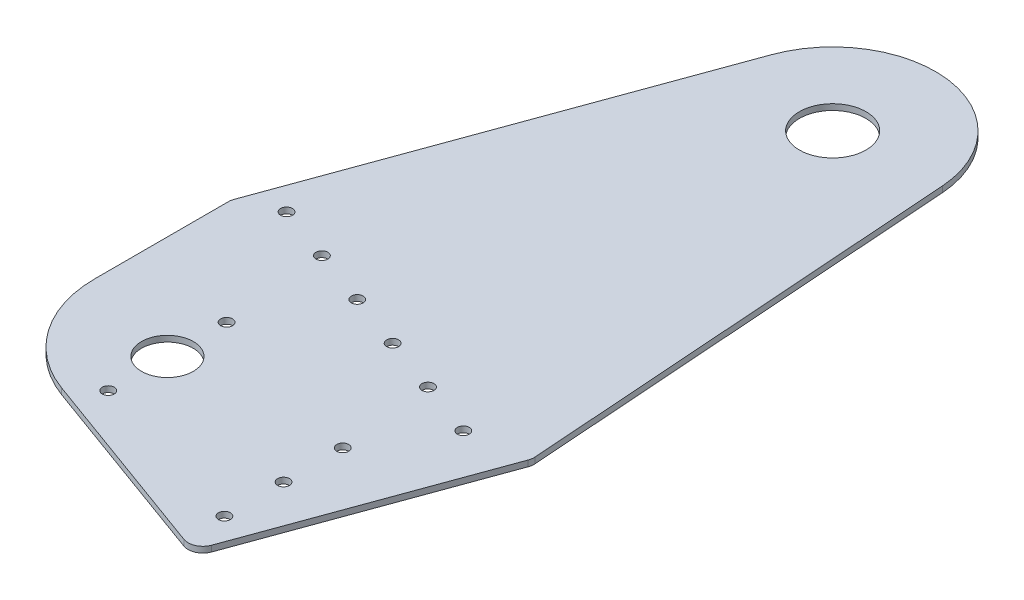
from build123d import *

# Parameters (mm, degrees)
SKETCH1_R                  = 14.2875
SKETCH1_R_2                = 11.1125
SKETCH1_R_3                = 2.5527
BOSS_EXTRUDE1_DEPTH        = 2.54
F_7_0_201_DIAMETER_HOLE1_D = 5.1054
CUT_EXTRUDE2_DEPTH         = 0.127


with BuildPart() as part:
    # Sketch1 → Boss-Extrude1 (new body)
    with BuildSketch(Plane(origin=(0, 0, 0), x_dir=(1, 0, 0), z_dir=(0, 1, 0))):
        with BuildLine():
            Line((0, 79.961539901), (0, 137.226043439))
            ThreePointArc((0, 137.226043439), (0.096470768, 138.328709367), (0.382951858, 139.397871349))
            Line((0.382951858, 139.397871349), (8.68731164, 162.213912335))
            Line((8.68731164, 162.213912335), (61.897095438, 308.406591813))
            ThreePointArc((61.897095438, 308.406591813), (109.5024689, 337.025784939), (147.412775028, 296.428513026))
            Line((147.412775028, 296.428513026), (160.751422837, 108.18172413))
            ThreePointArc((160.751422837, 108.18172413), (160.705914605, 106.852067788), (160.384352079, 105.56107804))
            Line((160.384352079, 105.56107804), (124.135089685, 5.967048142))
            ThreePointArc((124.135089685, 5.967048142), (120.851667505, 2.383821604), (115.996213633, 2.17182791))
            Line((115.996213633, 2.17182791), (33.425376719, 32.225154765))
            ThreePointArc((33.425376719, 32.225154765), (9.18707615, 50.823856935), (0, 79.961539901))
        make_face()
        with Locations(Location((103.379027621, 293.308403239, 0), (0, 0, 270))):
            Circle(SKETCH1_R, mode=Mode.SUBTRACT)
        with Locations(Location((44.45, 66.621712158, 0), (0, 0, 270))):
            Circle(SKETCH1_R_2, mode=Mode.SUBTRACT)
        with Locations(Location((44.45, 92.021712158, 0), (0, 0, 270))):
            Circle(SKETCH1_R_3, mode=Mode.SUBTRACT)
        with Locations(Location((44.45, 41.221712158, 0), (0, 0, 270))):
            Circle(SKETCH1_R_3, mode=Mode.SUBTRACT)
    extrude(amount=BOSS_EXTRUDE1_DEPTH)

    # #7 (0.201) Diameter Hole1 (through all)
    with Locations(Plane(origin=(0, 0, 0), x_dir=(-1, 0, 0), z_dir=(0, -1, 0))):
        with Locations((-135.618714944, 102.499602028), (-111.750522376, 111.186913669), (-87.882329808, 119.874225309), (-64.01413724, 128.56153695), (-40.145944672, 137.24884859), (-16.277752104, 145.936160231), (-116.079027621, 70.264108059), (-116.079027621, 44.864108059), (-116.079027621, 19.464108059)):
            Hole(F_7_0_201_DIAMETER_HOLE1_D / 2)

    # Sketch8 → Cut-Extrude2 (cut)
    with BuildSketch(Plane.XZ):
        with BuildLine():
            Line((142.678490111, -130.340522947), (147.199116848, -128.694042912))
            Line((147.199116848, -128.694042912), (147.461274834, -128.598131454))
            add(Edge.make_bspline(
                [(147.461274834, -128.598131454), (147.518382895, -128.578494473), (147.626739014, -128.541235514), (147.787225286, -128.51166484), (147.932937235, -128.507826746), (148.064673628, -128.525858863), (148.180584134, -128.569593537), (148.277897741, -128.640688135), (148.356925993, -128.734389109), (148.388285391, -128.811211473), (148.404404174, -128.850698294)],
                knots=[0, 0, 0, 0, 1.313667116, 2.492535482, 3.536993606, 4.475555594, 5.371860396, 6.202696431, 7.07618301, 8, 8, 8, 8], degree=3))
            add(Edge.make_bspline(
                [(148.404404174, -128.850698294), (148.424169517, -128.91612278), (148.461448654, -129.039518992), (148.440013448, -129.233024254), (148.352337864, -129.407393409), (148.254428083, -129.49515453), (148.202990111, -129.541260794)],
                knots=[0, 0, 0, 0, 1.048991658, 1.978488549, 2.93797689, 4, 4, 4, 4], degree=3))
            add(Edge.make_bspline(
                [(148.202990111, -129.541260794), (148.159429494, -129.576572856), (148.082907471, -129.638604816), (147.980715302, -129.718381547), (147.913280409, -129.778909029), (147.857086074, -129.825049715), (147.818175397, -129.89109086), (147.802772245, -129.946730628), (147.793767889, -129.979256454)],
                knots=[0, 0, 0, 0, 1.645585609, 2.890765756, 3.799650786, 4.308634086, 5.011263433, 6, 6, 6, 6], degree=3))
            add(Edge.make_bspline(
                [(147.793767889, -129.979256454), (147.785886213, -130.016395691), (147.768901756, -130.096428127), (147.774931396, -130.229069226), (147.805478092, -130.379334101), (147.841403635, -130.482653017), (147.86090591, -130.53873996)],
                knots=[0, 0, 0, 0, 0.793290123, 1.709484242, 2.756587552, 4, 4, 4, 4], degree=3))
            Line((147.86090591, -130.53873996), (151.531117716, -140.62223128))
            add(Edge.make_bspline(
                [(151.531117716, -140.62223128), (151.552552433, -140.674879266), (151.592342158, -140.772610853), (151.661839447, -140.903444941), (151.740998994, -141.006154518), (151.804985412, -141.053925387), (151.834837334, -141.076212183)],
                knots=[0, 0, 0, 0, 1.228251267, 2.280029168, 3.197572906, 4, 4, 4, 4], degree=3))
            add(Edge.make_bspline(
                [(151.834837334, -141.076212183), (151.861350797, -141.096403836), (151.907327023, -141.131417595), (151.980932967, -141.152552279), (152.052283582, -141.148502859), (152.142814391, -141.150860556), (152.27181157, -141.146168724), (152.370884771, -141.142310732), (152.426291327, -141.140153155)],
                knots=[0, 0, 0, 0, 0.97626264, 1.692908647, 2.195740748, 3.075696926, 4.364587386, 6, 6, 6, 6], degree=3))
            add(Edge.make_bspline(
                [(152.426291327, -141.140153155), (152.495265984, -141.140747157), (152.624906927, -141.14186361), (152.801921435, -141.216609752), (152.939953417, -141.347195219), (152.990802934, -141.462634179), (153.01774532, -141.523798988)],
                knots=[0, 0, 0, 0, 1.07887602, 2.02779556, 2.955036411, 4, 4, 4, 4], degree=3))
            add(Edge.make_bspline(
                [(153.01774532, -141.523798988), (153.028856949, -141.562842138), (153.050477636, -141.638811165), (153.056909688, -141.757617775), (153.019893966, -141.869546486), (152.962045496, -141.97703868), (152.874336038, -142.077424934), (152.754991794, -142.162088552), (152.614338132, -142.243321023), (152.507963878, -142.285063252), (152.451867716, -142.307075898)],
                knots=[0, 0, 0, 0, 0.895180691, 1.741816617, 2.574963405, 3.458649021, 4.425078252, 5.482965102, 6.672648756, 8, 8, 8, 8], degree=3))
            Line((152.451867716, -142.307075898), (152.18970973, -142.402987356))
            Line((152.18970973, -142.402987356), (147.669082993, -144.049467391))
            Line((147.669082993, -144.049467391), (147.406925007, -144.142181801))
            add(Edge.make_bspline(
                [(147.406925007, -144.142181801), (147.349745899, -144.16153136), (147.241066457, -144.198308767), (147.081237643, -144.231525583), (146.935409722, -144.239460583), (146.804132632, -144.221543928), (146.691343108, -144.175651309), (146.593380285, -144.110754032), (146.519008615, -144.01831589), (146.486720418, -143.94588159), (146.470189764, -143.908797252)],
                knots=[0, 0, 0, 0, 1.331017513, 2.529844268, 3.588880398, 4.539838543, 5.426110059, 6.254348996, 7.106275473, 8, 8, 8, 8], degree=3))
            add(Edge.make_bspline(
                [(146.470189764, -143.908797252), (146.451784765, -143.844376967), (146.417053282, -143.722811515), (146.437696868, -143.532807998), (146.525851114, -143.360482553), (146.625344339, -143.27582515), (146.677997924, -143.231022947)],
                knots=[0, 0, 0, 0, 1.042573949, 1.967407834, 2.924316062, 4, 4, 4, 4], degree=3))
            add(Edge.make_bspline(
                [(146.677997924, -143.231022947), (146.721974555, -143.197282855), (146.799624815, -143.137707421), (146.897327677, -143.055687447), (146.969571781, -143.002977485), (147.023622755, -142.955860948), (147.067010147, -142.892160854), (147.081836933, -142.835441769), (147.090417195, -142.802618433)],
                knots=[0, 0, 0, 0, 1.637578594, 2.891499403, 3.766902875, 4.279459033, 5.004322902, 6, 6, 6, 6], degree=3))
            add(Edge.make_bspline(
                [(147.090417195, -142.802618433), (147.09837975, -142.766541128), (147.115339801, -142.689697338), (147.108225734, -142.561652516), (147.082888987, -142.416320343), (147.048312135, -142.316256983), (147.029673271, -142.262317217)],
                knots=[0, 0, 0, 0, 0.799685466, 1.703310806, 2.761955671, 4, 4, 4, 4], degree=3))
            Line((147.029673271, -142.262317217), (143.359461466, -132.178825898))
            add(Edge.make_bspline(
                [(143.359461466, -132.178825898), (143.325423382, -132.095015579), (143.264017082, -131.943817829), (143.136177971, -131.759986022), (142.983761802, -131.638048072), (142.867743961, -131.625356564), (142.812766153, -131.619342391)],
                knots=[0, 0, 0, 0, 1.300292944, 2.345789501, 3.21611309, 4, 4, 4, 4], degree=3))
            Line((142.812766153, -131.619342391), (142.45149966, -131.635327634))
            add(Edge.make_bspline(
                [(142.45149966, -131.635327634), (142.383505038, -131.63490184), (142.2543355, -131.634092957), (142.077237377, -131.554495313), (141.937893982, -131.418414732), (141.884899127, -131.298936914), (141.856848618, -131.235696558)],
                knots=[0, 0, 0, 0, 1.045675563, 1.986472254, 2.934227166, 4, 4, 4, 4], degree=3))
            add(Edge.make_bspline(
                [(141.856848618, -131.235696558), (141.844587257, -131.193425544), (141.82100975, -131.112142147), (141.812614078, -130.988308401), (141.838612576, -130.871193314), (141.900676924, -130.767376393), (141.98594369, -130.668355478), (142.103112008, -130.580032771), (142.24921399, -130.500326292), (142.358245658, -130.456555946), (142.416332125, -130.433237356)],
                knots=[0, 0, 0, 0, 0.949533234, 1.825867897, 2.652690171, 3.498223352, 4.412470925, 5.462780625, 6.648299973, 8, 8, 8, 8], degree=3))
            Line((142.416332125, -130.433237356), (142.678490111, -130.340522947))
        make_face()
        with BuildLine():
            Line((142.256479695, -141.610119301), (136.354727959, -134.694903155))
            add(Edge.make_bspline(
                [(136.354727959, -134.694903155), (136.282693971, -134.611341769), (136.154587246, -134.462734482), (135.944269963, -134.291333932), (135.729421176, -134.182086075), (135.578011051, -134.165979079), (135.50111598, -134.157798988)],
                knots=[0, 0, 0, 0, 1.269579583, 2.257846421, 3.115230736, 4, 4, 4, 4], degree=3))
            add(Edge.make_bspline(
                [(135.50111598, -134.157798988), (135.433623459, -134.150079088), (135.324715424, -134.137622018), (135.218576534, -134.110547864), (135.17821407, -134.100252113)],
                knots=[0, 0, 0, 0, 1.239440611, 2, 2, 2, 2], degree=3))
            add(Edge.make_bspline(
                [(135.17821407, -134.100252113), (135.118952997, -134.062962779), (134.993975087, -133.984321894), (134.93452722, -133.848676368), (134.903267889, -133.777350204)],
                knots=[0, 0, 0, 0, 0.948344748, 2, 2, 2, 2], degree=3))
            add(Edge.make_bspline(
                [(134.903267889, -133.777350204), (134.889926791, -133.734041455), (134.864919241, -133.652860304), (134.853427032, -133.529592279), (134.87248326, -133.414585076), (134.922904454, -133.309868815), (134.99867301, -133.215286565), (135.101835683, -133.131494777), (135.229261488, -133.054377361), (135.327725117, -133.016982337), (135.379628132, -132.997270342)],
                knots=[0, 0, 0, 0, 1.03998122, 1.949418415, 2.819391159, 3.685214567, 4.592008043, 5.583233491, 6.726052746, 8, 8, 8, 8], degree=3))
            Line((135.379628132, -132.997270342), (140.456541327, -131.149376245))
            add(Edge.make_bspline(
                [(140.456541327, -131.149376245), (140.517863733, -131.128354033), (140.633470242, -131.088722441), (140.804929368, -131.060315622), (140.960607661, -131.054069111), (141.101258503, -131.079977172), (141.22416636, -131.131663926), (141.331703452, -131.206013333), (141.413122909, -131.313247515), (141.448404268, -131.396749235), (141.466808688, -131.440307669)],
                knots=[0, 0, 0, 0, 1.306819532, 2.463648305, 3.496779858, 4.437970598, 5.325217765, 6.173237362, 7.047074481, 8, 8, 8, 8], degree=3))
            add(Edge.make_bspline(
                [(141.466808688, -131.440307669), (141.481627461, -131.493256705), (141.511449099, -131.599812555), (141.479404138, -131.770707029), (141.394878419, -131.93753168), (141.304641514, -132.031861329), (141.25580348, -132.08291444)],
                knots=[0, 0, 0, 0, 0.90866313, 1.828614434, 2.82480229, 4, 4, 4, 4], degree=3))
            add(Edge.make_bspline(
                [(141.25580348, -132.08291444), (141.199856294, -132.141828615), (141.106715713, -132.239908625), (140.992611719, -132.37422139), (140.951451329, -132.508864898), (140.966543087, -132.59014908), (140.974463202, -132.632806801)],
                knots=[0, 0, 0, 0, 1.499726916, 2.496737491, 3.211091854, 4, 4, 4, 4], degree=3))
            add(Edge.make_bspline(
                [(140.974463202, -132.632806801), (140.981511892, -132.647967041), (140.998927828, -132.685425029), (141.04464333, -132.745994491), (141.102804795, -132.828811014), (141.151918679, -132.887880806), (141.179074313, -132.920541176)],
                knots=[0, 0, 0, 0, 0.565575118, 1.397425436, 2.561006461, 4, 4, 4, 4], degree=3))
            Line((141.179074313, -132.920541176), (143.931733167, -136.261456974))
            add(Edge.make_bspline(
                [(143.931733167, -136.261456974), (143.992822651, -136.336086686), (144.108436841, -136.477326275), (144.251477158, -136.694267991), (144.371460749, -136.89472262), (144.426678174, -137.031196108), (144.452852091, -137.095886662)],
                knots=[0, 0, 0, 0, 1.170241372, 2.214726656, 3.153752698, 4, 4, 4, 4], degree=3))
            add(Edge.make_bspline(
                [(144.452852091, -137.095886662), (144.470321072, -137.157264383), (144.507133537, -137.286605941), (144.511623348, -137.499537886), (144.486749013, -137.733355025), (144.44159093, -137.891404659), (144.417684556, -137.97507503)],
                knots=[0, 0, 0, 0, 0.853375566, 1.798322301, 2.834447219, 4, 4, 4, 4], degree=3))
            Line((144.417684556, -137.97507503), (143.058938896, -142.300681801))
            add(Edge.make_bspline(
                [(143.058938896, -142.300681801), (143.031537402, -142.399180702), (142.978550078, -142.589651816), (142.948416489, -142.878860128), (142.968539988, -143.158224795), (143.022557454, -143.332978588), (143.04934775, -143.419648815)],
                knots=[0, 0, 0, 0, 1.075096436, 2.078955324, 3.047245992, 4, 4, 4, 4], degree=3))
            add(Edge.make_bspline(
                [(143.04934775, -143.419648815), (143.068185986, -143.465099779), (143.105612577, -143.555398825), (143.187323238, -143.679356485), (143.291158481, -143.786850627), (143.408657563, -143.884136985), (143.542965087, -143.960380341), (143.68665906, -144.014014835), (143.837408037, -144.048354685), (143.94006954, -144.051207904), (143.992477091, -144.05266444)],
                knots=[0, 0, 0, 0, 0.974189936, 1.935457784, 2.922174346, 3.928831118, 4.95111638, 5.967706416, 6.962536819, 8, 8, 8, 8], degree=3))
            Line((143.992477091, -144.05266444), (144.459246188, -144.055861488))
            add(Edge.make_bspline(
                [(144.459246188, -144.055861488), (144.527177305, -144.058037625), (144.652913568, -144.062065519), (144.820367499, -144.129539488), (144.953593443, -144.235166526), (144.998880485, -144.334571168), (145.021926743, -144.385157495)],
                knots=[0, 0, 0, 0, 1.159630891, 2.146404475, 3.056718205, 4, 4, 4, 4], degree=3))
            add(Edge.make_bspline(
                [(145.021926743, -144.385157495), (145.034508339, -144.429550186), (145.059041528, -144.516112674), (145.062911946, -144.652335707), (145.03046591, -144.785865189), (144.984566585, -144.865636373), (144.96118282, -144.906276419)],
                knots=[0, 0, 0, 0, 1.014563119, 1.978323598, 2.970041326, 4, 4, 4, 4], degree=3))
            add(Edge.make_bspline(
                [(144.96118282, -144.906276419), (144.939963577, -144.934080658), (144.89417647, -144.994076939), (144.792784278, -145.065653881), (144.66823334, -145.13691318), (144.571803471, -145.174054272), (144.519990111, -145.194010794)],
                knots=[0, 0, 0, 0, 0.780956791, 1.685156822, 2.756196579, 4, 4, 4, 4], degree=3))
            Line((144.519990111, -145.194010794), (140.926507473, -146.501603676))
            add(Edge.make_bspline(
                [(140.926507473, -146.501603676), (140.865194019, -146.522641529), (140.748608754, -146.562644229), (140.574875821, -146.590956153), (140.415217076, -146.595880068), (140.270895342, -146.574222265), (140.141451905, -146.527812628), (140.037751179, -146.446745395), (139.95003204, -146.345976305), (139.915121476, -146.263130188), (139.89705782, -146.220263398)],
                knots=[0, 0, 0, 0, 1.293300657, 2.459163372, 3.502899085, 4.472757678, 5.362626851, 6.214478627, 7.076123646, 8, 8, 8, 8], degree=3))
            add(Edge.make_bspline(
                [(139.89705782, -146.220263398), (139.877590435, -146.152521572), (139.839696815, -146.020660869), (139.879017128, -145.812617378), (139.98362033, -145.618194767), (140.095760936, -145.514880754), (140.156018757, -145.459365829)],
                knots=[0, 0, 0, 0, 0.970145965, 1.888406845, 2.865352981, 4, 4, 4, 4], degree=3))
            Line((140.156018757, -145.459365829), (140.625984903, -145.050143606))
            add(Edge.make_bspline(
                [(140.625984903, -145.050143606), (140.67826941, -145.003294922), (140.792526904, -144.900916349), (140.952895338, -144.707514916), (141.129755127, -144.475876788), (141.241228761, -144.299827478), (141.30056216, -144.206122773)],
                knots=[0, 0, 0, 0, 0.775904004, 1.695585414, 2.773443132, 4, 4, 4, 4], degree=3))
            add(Edge.make_bspline(
                [(141.30056216, -144.206122773), (141.348908795, -144.120536567), (141.455248439, -143.932287547), (141.594059344, -143.608223154), (141.742333886, -143.225442887), (141.835653717, -142.947986245), (141.885622056, -142.799421384)],
                knots=[0, 0, 0, 0, 0.77236567, 1.698837777, 2.767836865, 4, 4, 4, 4], degree=3))
            Line((141.885622056, -142.799421384), (142.256479695, -141.610119301))
        make_face()
        with BuildLine():
            Line((127.693648674, -135.792302382), (132.214275411, -134.149019396))
            Line((132.214275411, -134.149019396), (132.476433397, -134.053107938))
            add(Edge.make_bspline(
                [(132.476433397, -134.053107938), (132.533541458, -134.033470958), (132.641897577, -133.996211998), (132.802383849, -133.966641324), (132.948095798, -133.96280323), (133.079832191, -133.980835347), (133.195742697, -134.024570022), (133.293056304, -134.095664619), (133.372084556, -134.189365594), (133.403443954, -134.266187957), (133.419562737, -134.305674778)],
                knots=[0, 0, 0, 0, 1.313667116, 2.492535482, 3.536993606, 4.475555594, 5.371860396, 6.202696431, 7.07618301, 8, 8, 8, 8], degree=3))
            add(Edge.make_bspline(
                [(133.419562737, -134.305674778), (133.43932808, -134.371099264), (133.476607217, -134.494495476), (133.455172011, -134.688000738), (133.367496427, -134.862369893), (133.269586646, -134.950131015), (133.218148674, -134.996237278)],
                knots=[0, 0, 0, 0, 1.048991658, 1.978488549, 2.93797689, 4, 4, 4, 4], degree=3))
            add(Edge.make_bspline(
                [(133.218148674, -134.996237278), (133.17446615, -135.031404761), (133.097729975, -135.093182742), (132.997274555, -135.173954937), (132.927609768, -135.230779478), (132.87234621, -135.276934859), (132.832655132, -135.343680808), (132.817747841, -135.400569221), (132.808926452, -135.434232938)],
                knots=[0, 0, 0, 0, 1.642959968, 2.886153347, 3.773498901, 4.281670084, 4.98317834, 6, 6, 6, 6], degree=3))
            add(Edge.make_bspline(
                [(132.808926452, -135.434232938), (132.801044776, -135.471372175), (132.784060319, -135.551404612), (132.790089959, -135.684045711), (132.820636655, -135.834310585), (132.856562198, -135.937629502), (132.876064473, -135.993716445)],
                knots=[0, 0, 0, 0, 0.793290123, 1.709484242, 2.756587552, 4, 4, 4, 4], degree=3))
            Line((132.876064473, -135.993716445), (136.546276279, -146.077207764))
            add(Edge.make_bspline(
                [(136.546276279, -146.077207764), (136.567710996, -146.129855751), (136.607500721, -146.227587337), (136.67699801, -146.358421426), (136.756157557, -146.461131003), (136.820143975, -146.508901871), (136.849995897, -146.531188667)],
                knots=[0, 0, 0, 0, 1.228251267, 2.280029168, 3.197572906, 4, 4, 4, 4], degree=3))
            add(Edge.make_bspline(
                [(136.849995897, -146.531188667), (136.876842759, -146.54950276), (136.923992106, -146.581666574), (136.995554905, -146.608252598), (137.067540453, -146.603182536), (137.157924687, -146.605982766), (137.286988407, -146.601090035), (137.386049888, -146.597267427), (137.44144989, -146.595129639)],
                knots=[0, 0, 0, 0, 0.960695384, 1.687204976, 2.190702953, 3.071824414, 4.362421688, 6, 6, 6, 6], degree=3))
            add(Edge.make_bspline(
                [(137.44144989, -146.595129639), (137.510424547, -146.595723641), (137.64006549, -146.596840094), (137.817079998, -146.671586236), (137.95511198, -146.802171704), (138.005961497, -146.917610663), (138.032903883, -146.978775472)],
                knots=[0, 0, 0, 0, 1.07887602, 2.02779556, 2.955036411, 4, 4, 4, 4], degree=3))
            add(Edge.make_bspline(
                [(138.032903883, -146.978775472), (138.044015512, -147.017818622), (138.065636199, -147.093787649), (138.072068251, -147.212594259), (138.035052529, -147.32452297), (137.977204059, -147.432015164), (137.889494601, -147.532401418), (137.770150357, -147.617065036), (137.629496695, -147.698297507), (137.523122441, -147.740039736), (137.467026279, -147.762052382)],
                knots=[0, 0, 0, 0, 0.895180691, 1.741816617, 2.574963405, 3.458649021, 4.425078252, 5.482965102, 6.672648756, 8, 8, 8, 8], degree=3))
            Line((137.467026279, -147.762052382), (137.204868293, -147.857963841))
            Line((137.204868293, -147.857963841), (132.684241556, -149.501246827))
            Line((132.684241556, -149.501246827), (132.42208357, -149.597158285))
            add(Edge.make_bspline(
                [(132.42208357, -149.597158285), (132.364979731, -149.616936371), (132.256631623, -149.654463064), (132.096056924, -149.682257153), (131.950479203, -149.69179075), (131.82008351, -149.672245681), (131.705808733, -149.631387789), (131.608638014, -149.565469489), (131.534140656, -149.473362184), (131.501870001, -149.400881712), (131.485348327, -149.363773736)],
                knots=[0, 0, 0, 0, 1.333158671, 2.529518515, 3.590258276, 4.542746192, 5.421969539, 6.251540833, 7.104837772, 8, 8, 8, 8], degree=3))
            add(Edge.make_bspline(
                [(131.485348327, -149.363773736), (131.466943328, -149.299353451), (131.432211845, -149.177787999), (131.452855431, -148.987784482), (131.541009677, -148.815459037), (131.640502902, -148.730801634), (131.693156487, -148.685999431)],
                knots=[0, 0, 0, 0, 1.042573949, 1.967407834, 2.924316062, 4, 4, 4, 4], degree=3))
            add(Edge.make_bspline(
                [(131.693156487, -148.685999431), (131.736945093, -148.65203029), (131.814263352, -148.592050421), (131.9143428, -148.511879557), (131.982388095, -148.454117423), (132.040099452, -148.411298891), (132.081788544, -148.34670014), (132.09685614, -148.29025799), (132.105575758, -148.257594917)],
                knots=[0, 0, 0, 0, 1.637886797, 2.892043602, 3.787214444, 4.279135215, 5.004135509, 6, 6, 6, 6], degree=3))
            add(Edge.make_bspline(
                [(132.105575758, -148.257594917), (132.113509178, -148.221516208), (132.130636885, -148.143624768), (132.123544396, -148.014486114), (132.098054889, -147.868098939), (132.063473268, -147.768036124), (132.044831834, -147.714096653)],
                knots=[0, 0, 0, 0, 0.79508296, 1.716529161, 2.769081105, 4, 4, 4, 4], degree=3))
            Line((132.044831834, -147.714096653), (128.374620029, -137.630605334))
            add(Edge.make_bspline(
                [(128.374620029, -137.630605334), (128.353997268, -137.575395965), (128.315610826, -137.472631293), (128.23656088, -137.341686181), (128.158718616, -137.234026993), (128.094463421, -137.183974637), (128.064506313, -137.160639188)],
                knots=[0, 0, 0, 0, 1.234302847, 2.297485558, 3.206252361, 4, 4, 4, 4], degree=3))
            add(Edge.make_bspline(
                [(128.064506313, -137.160639188), (128.037869025, -137.140638819), (127.990616409, -137.105159616), (127.916571669, -137.082316023), (127.843909365, -137.080119351), (127.753322872, -137.080396865), (127.624387364, -137.084611628), (127.525271915, -137.086212181), (127.469855272, -137.08710707)],
                knots=[0, 0, 0, 0, 0.969960246, 1.720639127, 2.221199932, 3.095475435, 4.37604529, 6, 6, 6, 6], degree=3))
            add(Edge.make_bspline(
                [(127.469855272, -137.08710707), (127.400816409, -137.085321433), (127.269725425, -137.081930866), (127.09108084, -137.004012505), (126.949572166, -136.871302092), (126.898778745, -136.753017179), (126.872007181, -136.690673042)],
                knots=[0, 0, 0, 0, 1.06378334, 2.019911687, 2.956359742, 4, 4, 4, 4], degree=3))
            add(Edge.make_bspline(
                [(126.872007181, -136.690673042), (126.858888191, -136.64949916), (126.833712994, -136.570486943), (126.836705551, -136.447432606), (126.859646952, -136.329641251), (126.922118206, -136.221494922), (127.009691634, -136.121192645), (127.127271181, -136.03273052), (127.269178366, -135.952204067), (127.375449111, -135.910307747), (127.431490688, -135.888213841)],
                knots=[0, 0, 0, 0, 0.932211671, 1.788903752, 2.642775182, 3.513125535, 4.464970859, 5.520948435, 6.692679159, 8, 8, 8, 8], degree=3))
            Line((127.431490688, -135.888213841), (127.693648674, -135.792302382))
        make_face()
        with BuildLine():
            Line((122.380044888, -153.252150331), (118.089605652, -141.46782915))
            add(Edge.make_bspline(
                [(118.089605652, -141.46782915), (118.065670848, -141.406282924), (118.021623064, -141.29301795), (117.936644784, -141.145927533), (117.847319011, -141.029245143), (117.772356007, -140.979257495), (117.737930304, -140.956301373)],
                knots=[0, 0, 0, 0, 1.250237205, 2.300841063, 3.21968522, 4, 4, 4, 4], degree=3))
            add(Edge.make_bspline(
                [(117.737930304, -140.956301373), (117.702648895, -140.936253277), (117.640789693, -140.901102775), (117.549987824, -140.878815541), (117.465074928, -140.887981141), (117.361618555, -140.892078421), (117.215788732, -140.90703637), (117.103861154, -140.916062456), (117.040973707, -140.921133838)],
                knots=[0, 0, 0, 0, 1.022213475, 1.792255813, 2.303892836, 3.166085326, 4.407741288, 6, 6, 6, 6], degree=3))
            add(Edge.make_bspline(
                [(117.040973707, -140.921133838), (116.961668707, -140.926618044), (116.81458413, -140.936789434), (116.60800719, -140.869491756), (116.444727492, -140.733198926), (116.38914151, -140.604798029), (116.360002353, -140.537488005)],
                knots=[0, 0, 0, 0, 1.108769337, 2.056400824, 2.98113088, 4, 4, 4, 4], degree=3))
            add(Edge.make_bspline(
                [(116.360002353, -140.537488005), (116.347969189, -140.494162341), (116.324168725, -140.408468261), (116.331509274, -140.272520768), (116.379693469, -140.13837988), (116.435635851, -140.058838377), (116.465504957, -140.016369081)],
                knots=[0, 0, 0, 0, 0.965229799, 1.909133572, 2.883631534, 4, 4, 4, 4], degree=3))
            add(Edge.make_bspline(
                [(116.465504957, -140.016369081), (116.494196903, -139.984181106), (116.557641381, -139.913006105), (116.690677596, -139.826241042), (116.85774028, -139.739762817), (116.984938372, -139.691050619), (117.053761902, -139.664693734)],
                knots=[0, 0, 0, 0, 0.743719897, 1.644535382, 2.725520262, 4, 4, 4, 4], degree=3))
            Line((117.053761902, -139.664693734), (117.37986086, -139.546402935))
            Line((117.37986086, -139.546402935), (121.900487596, -137.903119949))
            Line((121.900487596, -137.903119949), (122.229783603, -137.781632102))
            add(Edge.make_bspline(
                [(122.229783603, -137.781632102), (122.298562024, -137.757503761), (122.427962944, -137.712108279), (122.61825042, -137.674192728), (122.78832568, -137.657897117), (122.939092506, -137.67405895), (123.069542051, -137.713523007), (123.177773308, -137.784656504), (123.263456217, -137.883055627), (123.298608221, -137.963723869), (123.316780131, -138.005425505)],
                knots=[0, 0, 0, 0, 1.399553308, 2.633143998, 3.722140047, 4.670177317, 5.531926726, 6.316143072, 7.129526246, 8, 8, 8, 8], degree=3))
            add(Edge.make_bspline(
                [(123.316780131, -138.005425505), (123.337685621, -138.076226566), (123.377169432, -138.209947211), (123.340565879, -138.418688517), (123.226788292, -138.602940423), (123.106579984, -138.688349794), (123.04183395, -138.734352588)],
                knots=[0, 0, 0, 0, 1.027586927, 1.940784261, 2.890874887, 4, 4, 4, 4], degree=3))
            add(Edge.make_bspline(
                [(123.04183395, -138.734352588), (122.988440011, -138.77148418), (122.894264995, -138.836976039), (122.772545956, -138.924594234), (122.685990211, -138.984363823), (122.617473562, -139.034682371), (122.565508768, -139.108292591), (122.547159073, -139.173529599), (122.53670027, -139.210712831)],
                knots=[0, 0, 0, 0, 1.641171953, 2.894661773, 3.782439402, 4.298979607, 5.030466937, 6, 6, 6, 6], degree=3))
            add(Edge.make_bspline(
                [(122.53670027, -139.210712831), (122.525372989, -139.250913146), (122.5009897, -139.337449005), (122.500584689, -139.485000474), (122.531839462, -139.652626521), (122.570314669, -139.768495203), (122.591050096, -139.830940262)],
                knots=[0, 0, 0, 0, 0.786847088, 1.693779954, 2.757109838, 4, 4, 4, 4], degree=3))
            Line((122.591050096, -139.830940262), (126.881489332, -151.615261442))
            Line((126.881489332, -151.615261442), (122.380044888, -153.252150331))
        make_face()
        with BuildLine():
            Line((118.901655999, -154.518181581), (117.431013638, -150.480309185))
            add(Edge.make_bspline(
                [(117.431013638, -150.480309185), (117.415596471, -150.431701779), (117.386217348, -150.339074971), (117.368149419, -150.196947812), (117.38248591, -150.062564967), (117.417054822, -149.935010806), (117.476659816, -149.821003556), (117.560402283, -149.724626206), (117.663692112, -149.6463787), (117.744482653, -149.612228135), (117.785886034, -149.59472672)],
                knots=[0, 0, 0, 0, 1.142059975, 2.176322057, 3.184311098, 4.152438217, 5.124977301, 6.039749157, 6.995414421, 8, 8, 8, 8], degree=3))
            add(Edge.make_bspline(
                [(117.785886034, -149.59472672), (117.827049569, -149.581249096), (117.906935204, -149.555093215), (118.031382201, -149.545764998), (118.152459338, -149.561812107), (118.308382976, -149.619702708), (118.493014349, -149.750835558), (118.593042556, -149.901805277), (118.64589211, -149.981569602)],
                knots=[0, 0, 0, 0, 0.752527784, 1.460422663, 2.153796339, 2.864608379, 4.343426758, 6, 6, 6, 6], degree=3))
            Line((118.64589211, -149.981569602), (118.971991068, -150.553841303))
            add(Edge.make_bspline(
                [(118.971991068, -150.553841303), (119.05416302, -150.694445361), (119.214288272, -150.968434959), (119.501023411, -151.336266138), (119.802168563, -151.668533606), (120.029877809, -151.853427283), (120.14211086, -151.944557449)],
                knots=[0, 0, 0, 0, 1.066855509, 2.078939379, 3.053150017, 4, 4, 4, 4], degree=3))
            add(Edge.make_bspline(
                [(120.14211086, -151.944557449), (120.21439522, -151.995652458), (120.358795566, -152.097723461), (120.59998004, -152.214647293), (120.856016705, -152.311166129), (121.037629793, -152.345770769), (121.129998881, -152.363370817)],
                knots=[0, 0, 0, 0, 0.978988362, 1.955696357, 2.960259616, 4, 4, 4, 4], degree=3))
            Line((121.129998881, -152.363370817), (121.561600443, -153.549475852))
            Line((121.561600443, -153.549475852), (118.901655999, -154.518181581))
        make_face()
        with BuildLine():
            Line((130.359878221, -150.349230192), (127.699933777, -151.314738873))
            Line((127.699933777, -151.314738873), (127.268332214, -150.128633838))
            add(Edge.make_bspline(
                [(127.268332214, -150.128633838), (127.328142312, -150.055613194), (127.445853409, -149.911902677), (127.580795947, -149.672704247), (127.690697985, -149.42824598), (127.735271523, -149.257694811), (127.757480652, -149.172716303)],
                knots=[0, 0, 0, 0, 1.042765101, 2.052245816, 3.029515627, 4, 4, 4, 4], degree=3))
            add(Edge.make_bspline(
                [(127.757480652, -149.172716303), (127.784454049, -149.031416369), (127.839474844, -148.74319036), (127.856207951, -148.295557076), (127.836639859, -147.829550033), (127.784361724, -147.517332758), (127.757480652, -147.356792692)],
                knots=[0, 0, 0, 0, 0.943126269, 1.923804995, 2.932434208, 4, 4, 4, 4], degree=3))
            Line((127.757480652, -147.356792692), (127.635992804, -146.707791824))
            add(Edge.make_bspline(
                [(127.635992804, -146.707791824), (127.624896585, -146.611530694), (127.604088684, -146.431019474), (127.666928934, -146.214340782), (127.745856218, -146.068443125), (127.832442619, -145.983630444), (127.930572361, -145.908119157), (128.007967938, -145.876892084), (128.048412075, -145.860573942)],
                knots=[0, 0, 0, 0, 1.676489011, 3.143793093, 3.852413562, 4.549951533, 5.242256962, 6, 6, 6, 6], degree=3))
            add(Edge.make_bspline(
                [(128.048412075, -145.860573942), (128.091704513, -145.8467602), (128.175841758, -145.819913705), (128.30586856, -145.815294147), (128.432474032, -145.832736344), (128.549604349, -145.886865113), (128.658607968, -145.959391454), (128.754267412, -146.055883213), (128.834477961, -146.173700613), (128.870673074, -146.264692366), (128.88923586, -146.311357796)],
                knots=[0, 0, 0, 0, 1.013707022, 1.970101903, 2.888785409, 3.851420622, 4.831666476, 5.811039318, 6.877384076, 8, 8, 8, 8], degree=3))
            Line((128.88923586, -146.311357796), (130.359878221, -150.349230192))
        make_face()
        with BuildLine():
            Line((112.120776719, -156.986029784), (107.130183837, -143.277085339))
            Line((107.130183837, -143.277085339), (111.641219428, -141.636999402))
            Line((111.641219428, -141.636999402), (111.903377414, -141.541087943))
            add(Edge.make_bspline(
                [(111.903377414, -141.541087943), (111.960485476, -141.521450963), (112.068841595, -141.484192004), (112.229327867, -141.45462133), (112.375039815, -141.450783236), (112.506776208, -141.468815353), (112.622686714, -141.512550027), (112.720000321, -141.583644625), (112.799028573, -141.677345599), (112.830387972, -141.754167963), (112.846506754, -141.793654784)],
                knots=[0, 0, 0, 0, 1.313667116, 2.492535482, 3.536993606, 4.475555594, 5.371860396, 6.202696431, 7.07618301, 8, 8, 8, 8], degree=3))
            add(Edge.make_bspline(
                [(112.846506754, -141.793654784), (112.866272097, -141.85907927), (112.903551234, -141.982475482), (112.882116028, -142.175980744), (112.794440444, -142.350349899), (112.696530663, -142.43811102), (112.645092692, -142.484217284)],
                knots=[0, 0, 0, 0, 1.048991658, 1.978488549, 2.93797689, 4, 4, 4, 4], degree=3))
            add(Edge.make_bspline(
                [(112.645092692, -142.484217284), (112.601410167, -142.519384767), (112.524673992, -142.581162748), (112.424218572, -142.661934943), (112.354553785, -142.718759484), (112.299290227, -142.764914865), (112.25959915, -142.831660813), (112.244691858, -142.888549227), (112.235870469, -142.922212943)],
                knots=[0, 0, 0, 0, 1.642959968, 2.886153347, 3.773498901, 4.281670084, 4.98317834, 6, 6, 6, 6], degree=3))
            add(Edge.make_bspline(
                [(112.235870469, -142.922212943), (112.227988793, -142.959352181), (112.211004336, -143.039384617), (112.217033976, -143.172025716), (112.247580672, -143.322290591), (112.283506215, -143.425609507), (112.30300849, -143.48169645)],
                knots=[0, 0, 0, 0, 0.793290123, 1.709484242, 2.756587552, 4, 4, 4, 4], degree=3))
            Line((112.30300849, -143.48169645), (115.973220296, -153.56518777))
            add(Edge.make_bspline(
                [(115.973220296, -153.56518777), (115.994655013, -153.617835756), (116.034444738, -153.715567343), (116.103942027, -153.846401431), (116.183101575, -153.949111008), (116.247087992, -153.996881877), (116.276939914, -154.019168673)],
                knots=[0, 0, 0, 0, 1.228251267, 2.280029168, 3.197572906, 4, 4, 4, 4], degree=3))
            add(Edge.make_bspline(
                [(116.276939914, -154.019168673), (116.303786776, -154.037482765), (116.350936123, -154.06964658), (116.422498923, -154.096232604), (116.49448447, -154.091162541), (116.584868704, -154.093962771), (116.713932424, -154.089070041), (116.812993905, -154.085247433), (116.868393907, -154.083109645)],
                knots=[0, 0, 0, 0, 0.960695384, 1.687204976, 2.190702953, 3.071824414, 4.362421688, 6, 6, 6, 6], degree=3))
            add(Edge.make_bspline(
                [(116.868393907, -154.083109645), (116.937368564, -154.083703647), (117.067009507, -154.0848201), (117.244024015, -154.159566241), (117.382055997, -154.290151709), (117.432905514, -154.405590669), (117.4598479, -154.466755478)],
                knots=[0, 0, 0, 0, 1.07887602, 2.02779556, 2.955036411, 4, 4, 4, 4], degree=3))
            add(Edge.make_bspline(
                [(117.4598479, -154.466755478), (117.47095953, -154.505798627), (117.492580216, -154.581767655), (117.499012269, -154.700574265), (117.461996546, -154.812502976), (117.404148076, -154.91999517), (117.316438618, -155.020381424), (117.197094374, -155.105045042), (117.056440712, -155.186277513), (116.950066458, -155.228019741), (116.893970296, -155.250032388)],
                knots=[0, 0, 0, 0, 0.895180691, 1.741816617, 2.574963405, 3.458649021, 4.425078252, 5.482965102, 6.672648756, 8, 8, 8, 8], degree=3))
            Line((116.893970296, -155.250032388), (116.63181231, -155.345943846))
            Line((116.63181231, -155.345943846), (112.120776719, -156.986029784))
        make_face()
        with BuildLine():
            add(Edge.make_bspline(
                [(106.736946858, -151.528667805), (106.580368334, -151.551597644), (106.285676377, -151.594753239), (105.869163835, -151.647334703), (105.506567313, -151.680295051), (105.100234048, -151.697882341), (104.640099133, -151.684003081), (104.28959249, -151.618282701), (104.118564046, -151.58621468)],
                knots=[0, 0, 0, 0, 1.080962351, 2.034448284, 2.867506985, 3.56695295, 4.812803526, 6, 6, 6, 6], degree=3))
            add(Edge.make_bspline(
                [(104.118564046, -151.58621468), (103.980935694, -151.551664346), (103.707939463, -151.483131151), (103.321730584, -151.313530337), (102.964276999, -151.09430098), (102.636749877, -150.827236281), (102.343484923, -150.516909924), (102.085629647, -150.168360586), (101.865260245, -149.782270314), (101.754733984, -149.503274354), (101.698398247, -149.361068846)],
                knots=[0, 0, 0, 0, 0.989670594, 1.96308637, 2.931967109, 3.910746254, 4.905803952, 5.906164368, 6.932762464, 8, 8, 8, 8], degree=3))
            add(Edge.make_bspline(
                [(101.698398247, -149.361068846), (101.650305118, -149.219203499), (101.556472588, -148.942415838), (101.474373318, -148.519092134), (101.438076574, -148.10643672), (101.449634994, -147.701432847), (101.514712865, -147.306267403), (101.628110635, -146.920263709), (101.787157513, -146.541627331), (101.931759872, -146.306169944), (102.005314914, -146.186399575)],
                knots=[0, 0, 0, 0, 1.083241915, 2.113468867, 3.112168566, 4.076895179, 5.038161543, 6.002394595, 6.983875856, 8, 8, 8, 8], degree=3))
            add(Edge.make_bspline(
                [(102.005314914, -146.186399575), (102.088184717, -146.065247298), (102.253408721, -145.823696533), (102.54344784, -145.494013481), (102.86427757, -145.195994257), (103.222401171, -144.923055634), (103.634340018, -144.672142881), (104.108533007, -144.426414173), (104.654731561, -144.188264769), (105.045044907, -144.039495017), (105.250319254, -143.961253742)],
                knots=[0, 0, 0, 0, 0.87740918, 1.749359253, 2.619910027, 3.493280424, 4.437955592, 5.501477256, 6.685972101, 8, 8, 8, 8], degree=3))
            Line((105.250319254, -143.961253742), (106.465197726, -143.520061034))
            Line((106.465197726, -143.520061034), (106.852040608, -144.581481173))
            add(Edge.make_bspline(
                [(106.852040608, -144.581481173), (106.735360467, -144.637102115), (106.527348513, -144.736260556), (106.261800292, -144.912042004), (106.066539286, -145.118433816), (105.989916863, -145.281047324), (105.9504729, -145.364758082)],
                knots=[0, 0, 0, 0, 1.263091124, 2.251780397, 3.100045321, 4, 4, 4, 4], degree=3))
            add(Edge.make_bspline(
                [(105.9504729, -145.364758082), (105.924073942, -145.45248385), (105.86836775, -145.637599813), (105.86516254, -145.948175749), (105.922947406, -146.290325191), (105.999337252, -146.522967443), (106.039990261, -146.646774575)],
                knots=[0, 0, 0, 0, 0.834986822, 1.761961086, 2.808964508, 4, 4, 4, 4], degree=3))
            Line((106.039990261, -146.646774575), (106.880814046, -148.955043673))
            add(Edge.make_bspline(
                [(106.880814046, -148.955043673), (106.911220969, -149.034090977), (106.968353461, -149.182615358), (107.056742016, -149.39017702), (107.149557242, -149.564359681), (107.266468884, -149.75886388), (107.450249663, -149.960905081), (107.632137448, -150.071829107), (107.724834879, -150.128360513)],
                knots=[0, 0, 0, 0, 1.028417399, 1.932324686, 2.736859612, 3.422647556, 4.686476113, 6, 6, 6, 6], degree=3))
            add(Edge.make_bspline(
                [(107.724834879, -150.128360513), (107.795823749, -150.165247727), (107.931642977, -150.23582207), (108.166693407, -150.279546922), (108.431309114, -150.261830258), (108.61933063, -150.227611129), (108.725511094, -150.208286728)],
                knots=[0, 0, 0, 0, 0.927459874, 1.774459626, 2.743181552, 4, 4, 4, 4], degree=3))
            Line((108.725511094, -150.208286728), (109.109156928, -151.26331277))
            add(Edge.make_bspline(
                [(109.109156928, -151.26331277), (109.013064851, -151.311091839), (108.842277341, -151.3960111), (108.622920705, -151.54336285), (108.462761354, -151.713626059), (108.395340071, -151.845326686), (108.361047553, -151.912313638)],
                knots=[0, 0, 0, 0, 1.269389684, 2.256126725, 3.113012912, 4, 4, 4, 4], degree=3))
            add(Edge.make_bspline(
                [(108.361047553, -151.912313638), (108.334616612, -151.987287007), (108.278811475, -152.145582511), (108.25474343, -152.399597797), (108.254409224, -152.651454842), (108.292196135, -152.80997072), (108.309894775, -152.884216416)],
                knots=[0, 0, 0, 0, 0.96112015, 2.029267212, 3.076947823, 4, 4, 4, 4], degree=3))
            Line((108.309894775, -152.884216416), (108.511308837, -153.440502874))
            Line((108.511308837, -153.440502874), (109.112353976, -155.086982909))
            add(Edge.make_bspline(
                [(109.112353976, -155.086982909), (109.15145833, -155.177793016), (109.232727339, -155.366520015), (109.401230025, -155.622719058), (109.589073795, -155.84732338), (109.73598783, -155.959724245), (109.802916476, -156.010929957)],
                knots=[0, 0, 0, 0, 1.013245932, 2.105788328, 3.137066629, 4, 4, 4, 4], degree=3))
            add(Edge.make_bspline(
                [(109.802916476, -156.010929957), (109.893778249, -156.059104772), (110.067846519, -156.151395583), (110.365794764, -156.217192698), (110.696637428, -156.199428216), (110.925814465, -156.14810427), (111.052962483, -156.11962961)],
                knots=[0, 0, 0, 0, 0.951114468, 1.822095741, 2.79169303, 4, 4, 4, 4], degree=3))
            Line((111.052962483, -156.11962961), (111.455790608, -157.229005478))
            Line((111.455790608, -157.229005478), (110.276079671, -157.657409992))
            add(Edge.make_bspline(
                [(110.276079671, -157.657409992), (110.087230242, -157.7240603), (109.720350474, -157.853542554), (109.172182526, -157.997432727), (108.650222826, -158.11110737), (108.149502548, -158.173130414), (107.672784979, -158.202708699), (107.220034094, -158.182430228), (106.790560661, -158.125074483), (106.518877574, -158.049464996), (106.385271511, -158.012282388)],
                knots=[0, 0, 0, 0, 1.208562379, 2.347886829, 3.419198761, 4.431115781, 5.391160613, 6.299173738, 7.163581718, 8, 8, 8, 8], degree=3))
            add(Edge.make_bspline(
                [(106.385271511, -158.012282388), (106.267696771, -157.972997075), (106.035985882, -157.895575388), (105.716155278, -157.722655163), (105.413980328, -157.529635545), (105.143657953, -157.295429789), (104.903365176, -157.030976971), (104.689627612, -156.742754415), (104.513563633, -156.424626068), (104.423122568, -156.198478617), (104.377524983, -156.084462075)],
                knots=[0, 0, 0, 0, 1.028382661, 2.026689241, 3.011785208, 4.004180633, 4.988440068, 5.976954447, 6.98004308, 8, 8, 8, 8], degree=3))
            add(Edge.make_bspline(
                [(104.377524983, -156.084462075), (104.339966508, -155.967914565), (104.265783837, -155.737718699), (104.19672655, -155.381785562), (104.176932609, -155.022137608), (104.190520578, -154.660485696), (104.25176811, -154.305315713), (104.352627395, -153.962683615), (104.48798618, -153.6330157), (104.612318383, -153.430473523), (104.674850504, -153.328606173)],
                knots=[0, 0, 0, 0, 1.022082567, 2.018740506, 3.017462579, 4.024123524, 5.035141904, 6.018035621, 7.00318313, 8, 8, 8, 8], degree=3))
            add(Edge.make_bspline(
                [(104.674850504, -153.328606173), (104.72353674, -153.251952839), (104.821873388, -153.097128136), (104.997702412, -152.879841608), (105.190783382, -152.669099704), (105.414128723, -152.465266909), (105.671848087, -152.253318296), (105.979747891, -152.028485531), (106.338421759, -151.781257162), (106.598860119, -151.616188618), (106.736946858, -151.528667805)],
                knots=[0, 0, 0, 0, 0.788257032, 1.59212463, 2.424125713, 3.269209056, 4.216294617, 5.321677984, 6.579929799, 8, 8, 8, 8], degree=3))
        make_face()
        with BuildLine():
            add(Edge.make_bspline(
                [(98.194101766, -161.158270362), (98.270073597, -161.095917942), (98.413676173, -160.978058888), (98.595878412, -160.787357786), (98.726515827, -160.592160824), (98.816950696, -160.39293887), (98.853064263, -160.176169278), (98.85307322, -159.94041675), (98.804813013, -159.681012771), (98.746304192, -159.505777585), (98.71522069, -159.41268182)],
                knots=[0, 0, 0, 0, 1.181739463, 2.233733589, 3.158035706, 3.996203798, 4.843437646, 5.779134428, 6.82013891, 8, 8, 8, 8], degree=3))
            Line((98.71522069, -159.41268182), (95.435048815, -150.400201785))
            add(Edge.make_bspline(
                [(95.435048815, -150.400201785), (95.382495259, -150.263539306), (95.285226625, -150.010597854), (95.110067365, -149.679627488), (94.928665206, -149.418319728), (94.780208053, -149.297816308), (94.712515829, -149.242870188)],
                knots=[0, 0, 0, 0, 1.268721404, 2.348210247, 3.246831025, 4, 4, 4, 4], degree=3))
            add(Edge.make_bspline(
                [(94.712515829, -149.242870188), (94.655166603, -149.208169921), (94.534947783, -149.135429179), (94.317581415, -149.077060203), (94.067692293, -149.060507504), (93.891869924, -149.075191477), (93.798159926, -149.083017757)],
                knots=[0, 0, 0, 0, 0.844605885, 1.770512551, 2.811725347, 4, 4, 4, 4], degree=3))
            Line((93.798159926, -149.083017757), (93.392134752, -147.967247792))
            add(Edge.make_bspline(
                [(93.392134752, -147.967247792), (93.582220106, -147.919344493), (93.957413975, -147.824792104), (94.525536009, -147.739067325), (95.086106911, -147.702790663), (95.63826409, -147.719287737), (96.182727467, -147.783902541), (96.720246748, -147.89527105), (97.250358782, -148.057889845), (97.591059025, -148.203892581), (97.762500204, -148.277361507)],
                knots=[0, 0, 0, 0, 1.050828565, 2.074144205, 3.076301083, 4.059753313, 5.032384468, 6.013175928, 7.000225368, 8, 8, 8, 8], degree=3))
            add(Edge.make_bspline(
                [(97.762500204, -148.277361507), (97.982040587, -148.385846922), (98.420256631, -148.602390451), (99.021936322, -149.027889333), (99.586980895, -149.512253105), (100.104578353, -150.070967425), (100.577625068, -150.700651042), (101.003976966, -151.399784122), (101.392142943, -152.167511828), (101.60267901, -152.714932992), (101.710855238, -152.996205257)],
                knots=[0, 0, 0, 0, 0.928534843, 1.853412389, 2.788693912, 3.750676258, 4.738803779, 5.774232866, 6.85637128, 8, 8, 8, 8], degree=3))
            add(Edge.make_bspline(
                [(101.710855238, -152.996205257), (101.808354007, -153.283562753), (101.998747623, -153.844708638), (102.198473913, -154.695153728), (102.314121486, -155.526849017), (102.350943419, -156.338371951), (102.307204804, -157.124968863), (102.182759811, -157.883094434), (101.977523063, -158.613785826), (101.772058109, -159.071737768), (101.669293606, -159.300785119)],
                knots=[0, 0, 0, 0, 1.12354981, 2.194045263, 3.230189029, 4.229852067, 5.198569233, 6.142816108, 7.07111858, 8, 8, 8, 8], degree=3))
            add(Edge.make_bspline(
                [(101.669293606, -159.300785119), (101.584001331, -159.46882454), (101.415705093, -159.800395041), (101.112433994, -160.259485782), (100.782245646, -160.683021446), (100.416007335, -161.065596548), (100.012360188, -161.408578626), (99.575099346, -161.722557782), (99.095307128, -161.997047896), (98.753927021, -162.149058544), (98.580944648, -162.226084598)],
                knots=[0, 0, 0, 0, 1.037757138, 2.047672211, 3.02633358, 3.994133099, 4.960452542, 5.94148984, 6.956922313, 8, 8, 8, 8], degree=3))
            Line((98.580944648, -162.226084598), (98.194101766, -161.158270362))
        make_face()
        with BuildLine():
            Line((97.375657322, -161.455595882), (97.762500204, -162.523410119))
            add(Edge.make_bspline(
                [(97.762500204, -162.523410119), (97.580030778, -162.575920272), (97.220644743, -162.679342618), (96.675175888, -162.772202358), (96.138502171, -162.824042064), (95.608211988, -162.816378375), (95.081525771, -162.758234921), (94.556286997, -162.648233533), (94.029069824, -162.489323726), (93.687182535, -162.344409399), (93.513622599, -162.270843278)],
                knots=[0, 0, 0, 0, 1.04496488, 2.05812992, 3.042216669, 4.010690543, 4.973170489, 5.956171532, 6.962445373, 8, 8, 8, 8], degree=3))
            add(Edge.make_bspline(
                [(93.513622599, -162.270843278), (93.286783087, -162.160062412), (92.833389913, -161.938640281), (92.206335499, -161.50863152), (91.619243104, -161.016714799), (91.088490839, -160.442705788), (90.595224266, -159.80601096), (90.160001429, -159.089895592), (89.762420687, -158.307332634), (89.5455484, -157.749115921), (89.434188572, -157.462482167)],
                knots=[0, 0, 0, 0, 0.933570744, 1.865965049, 2.80667111, 3.764150087, 4.754598013, 5.78391833, 6.862083858, 8, 8, 8, 8], degree=3))
            add(Edge.make_bspline(
                [(89.434188572, -157.462482167), (89.336429558, -157.178373101), (89.145596974, -156.623771894), (88.950733394, -155.787212557), (88.822468467, -154.977239896), (88.787255931, -154.192042575), (88.816780713, -153.431746098), (88.939767822, -152.698394071), (89.128974215, -151.986556985), (89.323993775, -151.538399384), (89.421400377, -151.314557688)],
                knots=[0, 0, 0, 0, 1.141074056, 2.227458127, 3.259519718, 4.25288533, 5.20965185, 6.145062148, 7.073512458, 8, 8, 8, 8], degree=3))
            add(Edge.make_bspline(
                [(89.421400377, -151.314557688), (89.504428191, -151.14647629), (89.669476712, -150.81235228), (89.973446662, -150.347087086), (90.309121664, -149.911882008), (90.686403412, -149.514057544), (91.100677749, -149.146996735), (91.555554355, -148.816135342), (92.046174773, -148.514866866), (92.396180266, -148.348797599), (92.573690308, -148.264573313)],
                knots=[0, 0, 0, 0, 1.002715609, 1.993268526, 2.968892704, 3.94142668, 4.923483779, 5.927545305, 6.948926438, 8, 8, 8, 8], degree=3))
            Line((92.573690308, -148.264573313), (92.979715481, -149.380343278))
            add(Edge.make_bspline(
                [(92.979715481, -149.380343278), (92.902392373, -149.431254648), (92.762733514, -149.523209355), (92.589520308, -149.68485788), (92.477018107, -149.873692458), (92.43146233, -150.009103586), (92.40744378, -150.080496924)],
                knots=[0, 0, 0, 0, 1.194863954, 2.158130196, 3.028903788, 4, 4, 4, 4], degree=3))
            add(Edge.make_bspline(
                [(92.40744378, -150.080496924), (92.389865651, -150.173984899), (92.352313581, -150.373702796), (92.373878491, -150.700630633), (92.440750416, -151.064953033), (92.525408412, -151.313351433), (92.570493259, -151.445636681)],
                knots=[0, 0, 0, 0, 0.816266601, 1.743786298, 2.798447216, 4, 4, 4, 4], degree=3))
            Line((92.570493259, -151.445636681), (95.850665134, -160.458116716))
            add(Edge.make_bspline(
                [(95.850665134, -160.458116716), (95.88297826, -160.538879151), (95.944390231, -160.692370345), (96.060119259, -160.899249629), (96.190082412, -161.073777033), (96.295447443, -161.163163589), (96.346207669, -161.206226091)],
                knots=[0, 0, 0, 0, 1.147384665, 2.180635623, 3.12351046, 4, 4, 4, 4], degree=3))
            add(Edge.make_bspline(
                [(96.346207669, -161.206226091), (96.414647054, -161.254355056), (96.546468839, -161.347056737), (96.783353329, -161.432552278), (97.06151836, -161.463688913), (97.262678596, -161.458506506), (97.375657322, -161.455595882)],
                knots=[0, 0, 0, 0, 0.921944472, 1.77576647, 2.750791534, 4, 4, 4, 4], degree=3))
        make_face()
        with BuildLine():
            Line((82.964376883, -167.598280248), (78.673937647, -155.813959068))
            add(Edge.make_bspline(
                [(78.673937647, -155.813959068), (78.650002844, -155.752412842), (78.605955059, -155.639147867), (78.520976779, -155.49205745), (78.431651007, -155.37537506), (78.356688002, -155.325387412), (78.3222623, -155.30243129)],
                knots=[0, 0, 0, 0, 1.250237205, 2.300841063, 3.21968522, 4, 4, 4, 4], degree=3))
            add(Edge.make_bspline(
                [(78.3222623, -155.30243129), (78.286980891, -155.282383194), (78.225121689, -155.247232692), (78.134319819, -155.224945458), (78.049406923, -155.234111058), (77.94595055, -155.238208338), (77.800120727, -155.253166287), (77.68819315, -155.262192373), (77.625305703, -155.267263755)],
                knots=[0, 0, 0, 0, 1.022213475, 1.792255813, 2.303892836, 3.166085326, 4.407741288, 6, 6, 6, 6], degree=3))
            add(Edge.make_bspline(
                [(77.625305703, -155.267263755), (77.546000702, -155.272747961), (77.398916126, -155.282919352), (77.192339185, -155.215621673), (77.029059487, -155.079328844), (76.973473505, -154.950927947), (76.944334348, -154.883617922)],
                knots=[0, 0, 0, 0, 1.108769337, 2.056400824, 2.98113088, 4, 4, 4, 4], degree=3))
            add(Edge.make_bspline(
                [(76.944334348, -154.883617922), (76.932301184, -154.840292258), (76.90850072, -154.754598178), (76.915841269, -154.618650685), (76.964025464, -154.484509797), (77.019967846, -154.404968294), (77.049836953, -154.362498998)],
                knots=[0, 0, 0, 0, 0.965229799, 1.909133572, 2.883631534, 4, 4, 4, 4], degree=3))
            add(Edge.make_bspline(
                [(77.049836953, -154.362498998), (77.078528899, -154.330311023), (77.141973377, -154.259136022), (77.275009592, -154.172370959), (77.442072276, -154.085892734), (77.569270367, -154.037180536), (77.638093897, -154.010823651)],
                knots=[0, 0, 0, 0, 0.743719897, 1.644535382, 2.725520262, 4, 4, 4, 4], degree=3))
            Line((77.638093897, -154.010823651), (77.964192855, -153.892532853))
            Line((77.964192855, -153.892532853), (82.484819591, -152.249249866))
            Line((82.484819591, -152.249249866), (82.814115598, -152.127762019))
            add(Edge.make_bspline(
                [(82.814115598, -152.127762019), (82.882894019, -152.103633678), (83.012294939, -152.058238196), (83.202582416, -152.020322646), (83.372657675, -152.004027034), (83.523424502, -152.020188867), (83.653874047, -152.059652924), (83.762105303, -152.130786421), (83.847788213, -152.229185545), (83.882940216, -152.309853787), (83.901112126, -152.351555422)],
                knots=[0, 0, 0, 0, 1.399553308, 2.633143998, 3.722140047, 4.670177317, 5.531926726, 6.316143072, 7.129526246, 8, 8, 8, 8], degree=3))
            add(Edge.make_bspline(
                [(83.901112126, -152.351555422), (83.922017617, -152.422356484), (83.961501427, -152.556077128), (83.924897875, -152.764818435), (83.811120287, -152.949070341), (83.69091198, -153.034479711), (83.626165946, -153.080482505)],
                knots=[0, 0, 0, 0, 1.027586927, 1.940784261, 2.890874887, 4, 4, 4, 4], degree=3))
            add(Edge.make_bspline(
                [(83.626165946, -153.080482505), (83.572772006, -153.117614098), (83.478596991, -153.183105956), (83.356877951, -153.270724151), (83.270322206, -153.330493741), (83.201805558, -153.380812289), (83.149840764, -153.454422508), (83.131491068, -153.519659516), (83.121032265, -153.556842748)],
                knots=[0, 0, 0, 0, 1.641171953, 2.894661773, 3.782439402, 4.298979607, 5.030466937, 6, 6, 6, 6], degree=3))
            add(Edge.make_bspline(
                [(83.121032265, -153.556842748), (83.109704985, -153.597043064), (83.085321695, -153.683578922), (83.084916684, -153.831130392), (83.116171458, -153.998756438), (83.154646665, -154.114625121), (83.175382091, -154.177070179)],
                knots=[0, 0, 0, 0, 0.786847088, 1.693779954, 2.757109838, 4, 4, 4, 4], degree=3))
            Line((83.175382091, -154.177070179), (87.465821328, -165.96139136))
            Line((87.465821328, -165.96139136), (82.964376883, -167.598280248))
        make_face()
        with BuildLine():
            Line((79.485987994, -168.864311498), (78.015345633, -164.826439103))
            add(Edge.make_bspline(
                [(78.015345633, -164.826439103), (77.999928466, -164.777831697), (77.970549343, -164.685204889), (77.952481414, -164.543077729), (77.966817905, -164.408694884), (78.001386817, -164.281140724), (78.060991812, -164.167133473), (78.144734279, -164.070756124), (78.248024107, -163.992508617), (78.328814648, -163.958358053), (78.370218029, -163.940856637)],
                knots=[0, 0, 0, 0, 1.142059975, 2.176322057, 3.184311098, 4.152438217, 5.124977301, 6.039749157, 6.995414421, 8, 8, 8, 8], degree=3))
            add(Edge.make_bspline(
                [(78.370218029, -163.940856637), (78.411381564, -163.927379014), (78.4912672, -163.901223133), (78.615714196, -163.891894916), (78.736791333, -163.907942025), (78.892714971, -163.965832626), (79.077346345, -164.096965476), (79.177374551, -164.247935194), (79.230224105, -164.327699519)],
                knots=[0, 0, 0, 0, 0.752527784, 1.460422663, 2.153796339, 2.864608379, 4.343426758, 6, 6, 6, 6], degree=3))
            Line((79.230224105, -164.327699519), (79.556323064, -164.899971221))
            add(Edge.make_bspline(
                [(79.556323064, -164.899971221), (79.638495016, -165.040575278), (79.798620267, -165.314564877), (80.085355406, -165.682396055), (80.386500558, -166.014663524), (80.614209804, -166.1995572), (80.726442855, -166.290687366)],
                knots=[0, 0, 0, 0, 1.066855509, 2.078939379, 3.053150017, 4, 4, 4, 4], degree=3))
            add(Edge.make_bspline(
                [(80.726442855, -166.290687366), (80.798727215, -166.341782376), (80.943127562, -166.443853378), (81.184312035, -166.56077721), (81.4403487, -166.657296047), (81.621961789, -166.691900687), (81.714330876, -166.709500735)],
                knots=[0, 0, 0, 0, 0.978988362, 1.955696357, 2.960259616, 4, 4, 4, 4], degree=3))
            Line((81.714330876, -166.709500735), (82.145932439, -167.895605769))
            Line((82.145932439, -167.895605769), (79.485987994, -168.864311498))
        make_face()
        with BuildLine():
            Line((90.944210216, -164.69536011), (88.284265772, -165.66086879))
            Line((88.284265772, -165.66086879), (87.85266421, -164.474763755))
            add(Edge.make_bspline(
                [(87.85266421, -164.474763755), (87.912474308, -164.401743111), (88.030185405, -164.258032594), (88.165127942, -164.018834164), (88.27502998, -163.774375897), (88.319603519, -163.603824728), (88.341812647, -163.518846221)],
                knots=[0, 0, 0, 0, 1.042765101, 2.052245816, 3.029515627, 4, 4, 4, 4], degree=3))
            add(Edge.make_bspline(
                [(88.341812647, -163.518846221), (88.368786045, -163.377546286), (88.423806839, -163.089320278), (88.440539947, -162.641686994), (88.420971855, -162.17567995), (88.36869372, -161.863462675), (88.341812647, -161.70292261)],
                knots=[0, 0, 0, 0, 0.943126269, 1.923804995, 2.932434208, 4, 4, 4, 4], degree=3))
            Line((88.341812647, -161.70292261), (88.2203248, -161.053921741))
            add(Edge.make_bspline(
                [(88.2203248, -161.053921741), (88.209228581, -160.957660611), (88.18842068, -160.777149391), (88.25126093, -160.5604707), (88.330188213, -160.414573043), (88.416774615, -160.329760361), (88.514904356, -160.254249074), (88.592299933, -160.223022002), (88.632744071, -160.20670386)],
                knots=[0, 0, 0, 0, 1.676489011, 3.143793093, 3.852413562, 4.549951533, 5.242256962, 6, 6, 6, 6], degree=3))
            add(Edge.make_bspline(
                [(88.632744071, -160.20670386), (88.676036509, -160.192890117), (88.760173753, -160.166043623), (88.890200555, -160.161424064), (89.016806028, -160.178866261), (89.133936344, -160.23299503), (89.242939964, -160.305521371), (89.338599407, -160.402013131), (89.418809957, -160.519830531), (89.455005069, -160.610822284), (89.473567855, -160.657487714)],
                knots=[0, 0, 0, 0, 1.013707022, 1.970101903, 2.888785409, 3.851420622, 4.831666476, 5.811039318, 6.877384076, 8, 8, 8, 8], degree=3))
            Line((89.473567855, -160.657487714), (90.944210216, -164.69536011))
        make_face()
        with BuildLine():
            Line((69.406429609, -172.694136962), (69.025980824, -171.651899115))
            add(Edge.make_bspline(
                [(69.025980824, -171.651899115), (69.103373942, -171.600032426), (69.245249507, -171.504951417), (69.393809204, -171.361552534), (69.468375462, -171.24520347), (69.507158394, -171.172940354), (69.520237434, -171.103391441), (69.508120079, -171.063489785), (69.502341067, -171.044459879)],
                knots=[0, 0, 0, 0, 2.053071465, 3.763650891, 4.493216254, 5.091982388, 5.56694804, 6, 6, 6, 6], degree=3))
            add(Edge.make_bspline(
                [(69.502341067, -171.044459879), (69.487461414, -171.023113758), (69.454503691, -170.975833117), (69.372825216, -170.924204325), (69.269846633, -170.875968023), (69.190555452, -170.85256562), (69.147468672, -170.839848768)],
                knots=[0, 0, 0, 0, 0.739051215, 1.636963227, 2.715927208, 4, 4, 4, 4], degree=3))
            add(Edge.make_bspline(
                [(69.147468672, -170.839848768), (69.063831894, -170.812516762), (68.903546906, -170.760136572), (68.679180343, -170.661086825), (68.483316348, -170.541948851), (68.309569583, -170.406359413), (68.159271804, -170.245283771), (68.029023309, -170.058214609), (67.912737111, -169.846049706), (67.852032374, -169.691809004), (67.820693498, -169.612182101)],
                knots=[0, 0, 0, 0, 1.117682195, 2.141972506, 3.108041246, 4.023733918, 4.93380263, 5.895591447, 6.913597159, 8, 8, 8, 8], degree=3))
            add(Edge.make_bspline(
                [(67.820693498, -169.612182101), (67.782696551, -169.488604459), (67.70818623, -169.246274203), (67.700697288, -168.863327861), (67.763557629, -168.483033021), (67.914432577, -168.115028785), (68.124000806, -167.774437488), (68.389602249, -167.480058944), (68.709113047, -167.246911252), (68.951083462, -167.144767942), (69.073936553, -167.092907795)],
                knots=[0, 0, 0, 0, 0.991040124, 1.943385578, 2.917294984, 3.941178788, 4.983988512, 5.9829786, 6.97591896, 8, 8, 8, 8], degree=3))
            add(Edge.make_bspline(
                [(69.073936553, -167.092907795), (69.211206441, -167.049562946), (69.47924172, -166.96492713), (69.897529692, -166.942008138), (70.305387336, -166.99990242), (70.694744089, -167.142450163), (71.052405371, -167.354386675), (71.358620753, -167.635345604), (71.608545174, -167.977440922), (71.718806812, -168.240040294), (71.77544263, -168.374924288)],
                knots=[0, 0, 0, 0, 1.03234446, 2.015771561, 2.984166147, 3.978652023, 4.979414923, 5.956363356, 6.950287384, 8, 8, 8, 8], degree=3))
            add(Edge.make_bspline(
                [(71.77544263, -168.374924288), (71.817358393, -168.509197218), (71.900877175, -168.776741228), (71.943996287, -169.200350745), (71.915782698, -169.631173963), (71.826424693, -170.066288694), (71.671895178, -170.49384734), (71.458706258, -170.906775188), (71.186249913, -171.299964042), (70.9644687, -171.535245934), (70.851495581, -171.655096163)],
                knots=[0, 0, 0, 0, 0.93677725, 1.866564942, 2.82114846, 3.808541481, 4.820718002, 5.844814579, 6.902170224, 8, 8, 8, 8], degree=3))
            add(Edge.make_bspline(
                [(70.851495581, -171.655096163), (70.765254013, -171.735280851), (70.578277853, -171.90912538), (70.248602138, -172.160986243), (69.85035577, -172.423642526), (69.560493254, -172.600262434), (69.406429609, -172.694136962)],
                knots=[0, 0, 0, 0, 0.791828258, 1.716724427, 2.786425499, 4, 4, 4, 4], degree=3))
        make_face()
        with BuildLine():
            Line((68.20753638, -171.949224636), (68.600773359, -173.023432969))
            Line((68.600773359, -173.023432969), (68.338615373, -173.154511962))
            add(Edge.make_bspline(
                [(68.338615373, -173.154511962), (68.164870943, -173.213612592), (67.820578208, -173.330726664), (67.288990549, -173.440657973), (66.756423207, -173.519469796), (66.223245831, -173.537798205), (65.701618919, -173.520203899), (65.204231918, -173.444005668), (64.731826918, -173.329688528), (64.437007222, -173.210353316), (64.291151831, -173.151314913)],
                knots=[0, 0, 0, 0, 1.06234859, 2.105154695, 3.139959423, 4.178221848, 5.191807104, 6.15937693, 7.089393277, 8, 8, 8, 8], degree=3))
            add(Edge.make_bspline(
                [(64.291151831, -173.151314913), (64.173482664, -173.095437893), (63.940863685, -172.984975181), (63.622063407, -172.773545325), (63.326363844, -172.539483814), (63.062491985, -172.271966387), (62.818621959, -171.980440945), (62.610407362, -171.654872336), (62.420196319, -171.305173614), (62.323277336, -171.054236384), (62.273814158, -170.92616908)],
                knots=[0, 0, 0, 0, 1.010951309, 1.998539341, 2.964542937, 3.936490356, 4.912942117, 5.911988431, 6.934370902, 8, 8, 8, 8], degree=3))
            add(Edge.make_bspline(
                [(62.273814158, -170.92616908), (62.23556442, -170.813786593), (62.159893423, -170.591455789), (62.082786869, -170.251644403), (62.024395227, -169.913591968), (62.005313525, -169.57520447), (62.005370126, -169.237183581), (62.0435186, -168.900691587), (62.103141365, -168.563655037), (62.193180718, -168.227911265), (62.311062235, -167.896601217), (62.457093772, -167.571523299), (62.625319796, -167.252289492), (62.822709138, -166.939689392), (63.045830715, -166.635022041), (63.293498274, -166.335117299), (63.568709052, -166.044263365), (63.767891578, -165.859866506), (63.869141415, -165.766132622)],
                knots=[0, 0, 0, 0, 0.98856828, 1.955724483, 2.900316033, 3.843696219, 4.776187893, 5.713740159, 6.661332537, 7.626366349, 8.606643174, 9.588567828, 10.593631514, 11.611210973, 12.666306529, 13.738529091, 14.850433489, 16, 16, 16, 16], degree=3))
            Line((63.869141415, -165.766132622), (64.994502526, -164.765456407))
            add(Edge.make_bspline(
                [(64.994502526, -164.765456407), (65.08490457, -164.682169694), (65.284526822, -164.49825924), (65.59051567, -164.175179351), (65.947164801, -163.796246668), (66.193174111, -163.517251882), (66.324474748, -163.368346163)],
                knots=[0, 0, 0, 0, 0.76412399, 1.687308652, 2.765665228, 4, 4, 4, 4], degree=3))
            Line((66.324474748, -163.368346163), (66.561056345, -163.090202934))
            add(Edge.make_bspline(
                [(66.561056345, -163.090202934), (66.69204304, -163.037833869), (66.950420289, -162.93453349), (67.250534317, -162.740960983), (67.496492266, -162.553913125), (67.712288658, -162.370437471), (67.96176567, -162.149883658), (68.13650658, -161.987633149), (68.22991572, -161.900900851)],
                knots=[0, 0, 0, 0, 1.227216732, 2.420741172, 3.097075587, 3.921391489, 4.888863323, 6, 6, 6, 6], degree=3))
            add(Edge.make_bspline(
                [(68.22991572, -161.900900851), (68.168637117, -162.096210109), (68.051312731, -162.470150402), (67.853300854, -162.919196785), (67.669995558, -163.277775699), (67.495127641, -163.582413617), (67.291780993, -163.936137037), (67.138400201, -164.183009881), (67.05659888, -164.314672552)],
                knots=[0, 0, 0, 0, 1.367029185, 2.617322384, 3.273454342, 4.057885267, 4.964227861, 6, 6, 6, 6], degree=3))
            add(Edge.make_bspline(
                [(67.05659888, -164.314672552), (67.003278459, -164.400970573), (66.900674256, -164.567033399), (66.754169453, -164.805438407), (66.6215674, -165.024712138), (66.504715881, -165.22422407), (66.401070553, -165.403607166), (66.315034553, -165.564233749), (66.241366932, -165.704854974), (66.122779026, -165.938536012), (65.988312367, -166.295865317), (65.929304389, -166.624896795), (65.899267283, -166.792385226)],
                knots=[0, 0, 0, 0, 1.103850512, 2.124133703, 3.044932501, 3.892182317, 4.64012594, 5.299081642, 5.874827285, 6.367502598, 8.150932867, 10, 10, 10, 10], degree=3))
            add(Edge.make_bspline(
                [(65.899267283, -166.792385226), (65.890236844, -166.881812407), (65.871671492, -167.065662524), (65.873748303, -167.350217266), (65.896393706, -167.648175945), (65.941747541, -167.962339743), (66.015574612, -168.299940165), (66.110481172, -168.669574213), (66.236524235, -169.073512942), (66.336194257, -169.351459862), (66.38841572, -169.497088351)],
                knots=[0, 0, 0, 0, 0.777109461, 1.597631333, 2.457455915, 3.360998945, 4.34102896, 5.445659078, 6.661669612, 8, 8, 8, 8], degree=3))
            add(Edge.make_bspline(
                [(66.38841572, -169.497088351), (66.435763351, -169.625197992), (66.526537245, -169.87080713), (66.666111154, -170.218883276), (66.805102897, -170.530602462), (66.936412474, -170.808410962), (67.070102772, -171.048592252), (67.191151696, -171.258314484), (67.315872286, -171.428648614), (67.403270134, -171.524649784), (67.443441762, -171.568775851)],
                knots=[0, 0, 0, 0, 1.401670402, 2.687253317, 3.847696378, 4.904279932, 5.839110807, 6.668151836, 7.387828071, 8, 8, 8, 8], degree=3))
            add(Edge.make_bspline(
                [(67.443441762, -171.568775851), (67.501205641, -171.623331255), (67.607030045, -171.723277678), (67.788736513, -171.834271382), (67.989004685, -171.902583241), (68.13042039, -171.932765708), (68.20753638, -171.949224636)],
                knots=[0, 0, 0, 0, 1.094333401, 2.004837285, 2.912009465, 4, 4, 4, 4], degree=3))
        make_face()
        with BuildLine():
            add(Edge.make_bspline(
                [(60.371570234, -165.395274983), (60.336857329, -165.408314415), (60.267916628, -165.434211056), (60.156745588, -165.430775952), (60.045439196, -165.405128498), (59.938737679, -165.345271906), (59.835986071, -165.263691079), (59.750704388, -165.154004724), (59.671417178, -165.02882848), (59.633625491, -164.933552934), (59.613869713, -164.883747205)],
                knots=[0, 0, 0, 0, 0.86008404, 1.708148529, 2.555111873, 3.514691059, 4.543120313, 5.606643348, 6.748861813, 8, 8, 8, 8], degree=3))
            add(Edge.make_bspline(
                [(59.613869713, -164.883747205), (59.573209559, -164.760979155), (59.488965815, -164.506616121), (59.425261108, -164.093924141), (59.389017293, -163.647292208), (59.393528794, -163.175589226), (59.434390696, -162.702244849), (59.506721659, -162.252055927), (59.609403372, -161.835465856), (59.709265424, -161.578191158), (59.757736901, -161.453314045)],
                knots=[0, 0, 0, 0, 0.885510729, 1.834689037, 2.853717882, 3.957294471, 5.064929051, 6.109018028, 7.082146941, 8, 8, 8, 8], degree=3))
            add(Edge.make_bspline(
                [(59.757736901, -161.453314045), (59.806835916, -161.350971044), (59.905713996, -161.144867529), (60.093746473, -160.852369674), (60.315871522, -160.574377741), (60.565189555, -160.311032441), (60.837191976, -160.076441272), (61.112783339, -159.8688081), (61.397587864, -159.706829767), (61.593026362, -159.62588519), (61.688754262, -159.586237657)],
                knots=[0, 0, 0, 0, 0.989574172, 1.992854529, 3.0252215, 4.090553387, 5.151454079, 6.155595621, 7.096590691, 8, 8, 8, 8], degree=3))
            add(Edge.make_bspline(
                [(61.688754262, -159.586237657), (61.807455634, -159.545602162), (62.049278831, -159.462817904), (62.430981851, -159.379586161), (62.832668786, -159.320107075), (63.108029847, -159.305815394), (63.248913984, -159.298503282)],
                knots=[0, 0, 0, 0, 0.94442742, 1.924025423, 2.937860403, 4, 4, 4, 4], degree=3))
            Line((63.248913984, -159.298503282), (64.716359297, -159.247350504))
            add(Edge.make_bspline(
                [(64.716359297, -159.247350504), (64.81441999, -159.243458795), (64.999962288, -159.236095227), (65.264289951, -159.219911204), (65.500961355, -159.201174434), (65.709817669, -159.178983298), (65.890848673, -159.155635165), (66.04423521, -159.136266575), (66.168861781, -159.10728184), (66.241453945, -159.084646718), (66.27332197, -159.074709879)],
                knots=[0, 0, 0, 0, 1.49996499, 2.838109172, 4.047419608, 5.128495426, 6.047754477, 6.837876487, 7.489826731, 8, 8, 8, 8], degree=3))
            add(Edge.make_bspline(
                [(66.27332197, -159.074709879), (66.346010112, -159.041023605), (66.499268487, -158.969998214), (66.693733868, -158.779795176), (66.871074239, -158.532321564), (66.964818441, -158.337989734), (67.015037248, -158.233886094)],
                knots=[0, 0, 0, 0, 0.831066771, 1.752252035, 2.795880503, 4, 4, 4, 4], degree=3))
            add(Edge.make_bspline(
                [(67.015037248, -158.233886094), (67.044118008, -158.169866281), (67.096879845, -158.05371378), (67.191662096, -157.913297678), (67.269820275, -157.802157371), (67.337574735, -157.766476389), (67.366712595, -157.751131754)],
                knots=[0, 0, 0, 0, 1.382109195, 2.507589937, 3.358187854, 4, 4, 4, 4], degree=3))
            add(Edge.make_bspline(
                [(67.366712595, -157.751131754), (67.403675953, -157.740112936), (67.473433462, -157.719318147), (67.580731857, -157.711212368), (67.68133017, -157.731762686), (67.777427026, -157.774027042), (67.862655591, -157.84315581), (67.942095164, -157.931696677), (68.008383987, -158.045350789), (68.042468796, -158.131065391), (68.060472144, -158.176339219)],
                knots=[0, 0, 0, 0, 1.002464518, 1.891858074, 2.767738862, 3.649311512, 4.59814576, 5.600226413, 6.732457096, 8, 8, 8, 8], degree=3))
            add(Edge.make_bspline(
                [(68.060472144, -158.176339219), (68.09135221, -158.271691628), (68.153685866, -158.464167387), (68.209441493, -158.767936983), (68.239073313, -159.084685509), (68.234370989, -159.41119885), (68.202757434, -159.739574156), (68.143255612, -160.062317662), (68.050189524, -160.375047675), (67.965416523, -160.573790278), (67.922999053, -160.673234184)],
                knots=[0, 0, 0, 0, 0.93848702, 1.89440416, 2.887279986, 3.916078206, 4.949665046, 5.976133468, 6.987327377, 8, 8, 8, 8], degree=3))
            add(Edge.make_bspline(
                [(67.922999053, -160.673234184), (67.873182505, -160.775809194), (67.773989526, -160.980052988), (67.582355996, -161.262584439), (67.360621155, -161.522153146), (67.108386834, -161.762032583), (66.823759251, -161.976885554), (66.510643759, -162.17521807), (66.164407657, -162.346504761), (65.919202135, -162.442994504), (65.793764678, -162.492354844)],
                knots=[0, 0, 0, 0, 0.94955951, 1.890729895, 2.835958059, 3.791069384, 4.786040357, 5.80394581, 6.876585444, 8, 8, 8, 8], degree=3))
            add(Edge.make_bspline(
                [(65.793764678, -162.492354844), (65.661028628, -162.536566144), (65.373754993, -162.63225033), (64.898177523, -162.751050117), (64.348404804, -162.86151551), (63.955705307, -162.925320259), (63.747653567, -162.959123941)],
                knots=[0, 0, 0, 0, 0.798634675, 1.728442912, 2.796531679, 4, 4, 4, 4], degree=3))
            add(Edge.make_bspline(
                [(63.747653567, -162.959123941), (63.594187377, -162.982494418), (63.300948912, -163.027150005), (62.882602477, -163.092041475), (62.508372959, -163.162152345), (62.175809973, -163.219258622), (61.888935879, -163.282338067), (61.64386072, -163.334531564), (61.442281534, -163.388294481), (61.323083614, -163.427566466), (61.269940894, -163.44507533)],
                knots=[0, 0, 0, 0, 1.474126949, 2.816716319, 4.019626711, 5.089481467, 6.020317193, 6.808410426, 7.468746502, 8, 8, 8, 8], degree=3))
            add(Edge.make_bspline(
                [(61.269940894, -163.44507533), (61.196108696, -163.474390304), (61.057805686, -163.529303326), (60.880375974, -163.647947025), (60.739279036, -163.784384914), (60.683242798, -163.896107816), (60.65610756, -163.950209011)],
                knots=[0, 0, 0, 0, 1.16236181, 2.177344601, 3.117389243, 4, 4, 4, 4], degree=3))
            add(Edge.make_bspline(
                [(60.65610756, -163.950209011), (60.642831491, -163.992480136), (60.616053702, -164.077740859), (60.605899463, -164.194142843), (60.611136691, -164.300985109), (60.622190091, -164.406302446), (60.63300349, -164.537868329), (60.647950086, -164.633394449), (60.65610756, -164.685530191)],
                knots=[0, 0, 0, 0, 1.070472236, 2.159139023, 2.804751834, 3.659791264, 4.722773223, 6, 6, 6, 6], degree=3))
            add(Edge.make_bspline(
                [(60.65610756, -164.685530191), (60.663948465, -164.769902014), (60.67819016, -164.923149362), (60.633967044, -165.134282556), (60.535820895, -165.306560146), (60.426665842, -165.36551682), (60.371570234, -165.395274983)],
                knots=[0, 0, 0, 0, 1.226228652, 2.227239891, 3.105205905, 4, 4, 4, 4], degree=3))
        make_face()
        with BuildLine():
            add(Edge.make_bspline(
                [(51.356851245, -163.37837188), (51.535303562, -163.341546284), (51.88569032, -163.269240129), (52.413172356, -163.227176068), (52.926288846, -163.230816051), (53.429005684, -163.293293295), (53.926516361, -163.40942035), (54.424630658, -163.585498522), (54.928663971, -163.814961129), (55.253637209, -164.00819751), (55.420300029, -164.107298963)],
                knots=[0, 0, 0, 0, 1.028783679, 2.01999157, 2.983594532, 3.923998606, 4.876396501, 5.864838233, 6.904980348, 8, 8, 8, 8], degree=3))
            add(Edge.make_bspline(
                [(55.420300029, -164.107298963), (55.604290064, -164.227051685), (55.975433529, -164.468616073), (56.485864412, -164.906413792), (56.967814193, -165.396938998), (57.413898797, -165.946059041), (57.830012696, -166.543662266), (58.207367535, -167.191413003), (58.545035473, -167.887380579), (58.732782899, -168.376001207), (58.828353849, -168.624728651)],
                knots=[0, 0, 0, 0, 0.91311141, 1.841922221, 2.792560322, 3.773085101, 4.783547686, 5.821484912, 6.891048684, 8, 8, 8, 8], degree=3))
            add(Edge.make_bspline(
                [(58.828353849, -168.624728651), (58.913841824, -168.875158913), (59.082100713, -169.368060021), (59.271794173, -170.114686614), (59.395762863, -170.852680119), (59.465054115, -171.577242228), (59.470607927, -172.284115942), (59.422719621, -172.969482595), (59.305025234, -173.630483345), (59.17868146, -174.054336873), (59.116088224, -174.264322401)],
                knots=[0, 0, 0, 0, 1.103764186, 2.172447469, 3.209691851, 4.223309562, 5.205979995, 6.155708058, 7.086300829, 8, 8, 8, 8], degree=3))
            add(Edge.make_bspline(
                [(59.116088224, -174.264322401), (59.052667708, -174.448062734), (58.929473002, -174.804979355), (58.687166314, -175.303206796), (58.422899569, -175.760197246), (58.113218472, -176.166602328), (57.771229135, -176.538346832), (57.380254235, -176.868638127), (56.951125114, -177.177917709), (56.636201915, -177.348602001), (56.475326071, -177.435794623)],
                knots=[0, 0, 0, 0, 1.09797503, 2.132822625, 3.126858563, 4.077608751, 5.015500372, 5.976806336, 6.966468682, 8, 8, 8, 8], degree=3))
            Line((56.475326071, -177.435794623), (56.101271383, -176.412739067))
            add(Edge.make_bspline(
                [(56.101271383, -176.412739067), (56.16467364, -176.359154176), (56.270045042, -176.270098749), (56.403928279, -176.143652916), (56.483628736, -176.011803917), (56.513577208, -175.91908273), (56.529675897, -175.869240804)],
                knots=[0, 0, 0, 0, 1.412544675, 2.34757908, 3.111747323, 4, 4, 4, 4], degree=3))
            add(Edge.make_bspline(
                [(56.529675897, -175.869240804), (56.548245648, -175.788626355), (56.587486425, -175.618275465), (56.572247086, -175.341506598), (56.522174157, -175.037871696), (56.452006424, -174.833630411), (56.414582147, -174.724697401)],
                knots=[0, 0, 0, 0, 0.845674443, 1.787041869, 2.819708796, 4, 4, 4, 4], degree=3))
            Line((56.414582147, -174.724697401), (53.083257495, -165.577941324))
            add(Edge.make_bspline(
                [(53.083257495, -165.577941324), (53.04053553, -165.466683554), (52.960260103, -165.257627978), (52.799858254, -164.983646934), (52.630907989, -164.754281031), (52.491119458, -164.642969581), (52.424665481, -164.590053304)],
                knots=[0, 0, 0, 0, 1.185053677, 2.226739582, 3.157010896, 4, 4, 4, 4], degree=3))
            add(Edge.make_bspline(
                [(52.424665481, -164.590053304), (52.379879222, -164.561431728), (52.296933866, -164.508423799), (52.149977912, -164.457194521), (51.964785156, -164.437818187), (51.824690807, -164.437054144), (51.740497078, -164.43659497)],
                knots=[0, 0, 0, 0, 0.889739687, 1.647821855, 2.586390887, 4, 4, 4, 4], degree=3))
            Line((51.740497078, -164.43659497), (51.356851245, -163.37837188))
        make_face()
        with BuildLine():
            Line((50.5384068, -163.675697401), (50.922052633, -164.733920491))
            add(Edge.make_bspline(
                [(50.922052633, -164.733920491), (50.859659589, -164.788485013), (50.754755006, -164.880227105), (50.622329417, -165.011331323), (50.547467592, -165.147950576), (50.516581003, -165.240597478), (50.500042217, -165.290206949)],
                knots=[0, 0, 0, 0, 1.400039184, 2.353956711, 3.118596146, 4, 4, 4, 4], degree=3))
            add(Edge.make_bspline(
                [(50.500042217, -165.290206949), (50.482537781, -165.373012681), (50.445542135, -165.54802269), (50.464492672, -165.832918575), (50.516669513, -166.14622824), (50.589388394, -166.357800066), (50.627924161, -166.469917887)],
                knots=[0, 0, 0, 0, 0.839840511, 1.775003902, 2.820912408, 4, 4, 4, 4], degree=3))
            Line((50.627924161, -166.469917887), (53.959248814, -175.616673963))
            add(Edge.make_bspline(
                [(53.959248814, -175.616673963), (54.000985909, -175.723662091), (54.079599121, -175.925177799), (54.237089609, -176.189204214), (54.402023264, -176.411863851), (54.539656863, -176.518653836), (54.605052633, -176.569394449)],
                knots=[0, 0, 0, 0, 1.177490189, 2.217842064, 3.153218464, 4, 4, 4, 4], degree=3))
            add(Edge.make_bspline(
                [(54.605052633, -176.569394449), (54.650041316, -176.596426172), (54.73288581, -176.646203788), (54.876854324, -176.701323759), (55.061397626, -176.708759792), (55.19988487, -176.709575843), (55.282826939, -176.710064588)],
                knots=[0, 0, 0, 0, 0.891592932, 1.641825465, 2.58765422, 4, 4, 4, 4], degree=3))
            Line((55.282826939, -176.710064588), (55.656881626, -177.733120144))
            add(Edge.make_bspline(
                [(55.656881626, -177.733120144), (55.478429822, -177.769941236), (55.128044072, -177.842238548), (54.600554758, -177.884366487), (54.086405408, -177.880486007), (53.582550487, -177.818545287), (53.084022762, -177.702042158), (52.585904219, -177.52600195), (52.081872107, -177.296528605), (51.7568987, -177.103293738), (51.590235793, -177.004193061)],
                knots=[0, 0, 0, 0, 1.028015547, 2.018483361, 2.981366858, 3.927041916, 4.878728712, 5.866432433, 6.905797935, 8, 8, 8, 8], degree=3))
            add(Edge.make_bspline(
                [(51.590235793, -177.004193061), (51.407393411, -176.884314064), (51.037816206, -176.642004028), (50.528681889, -176.205331109), (50.045311066, -175.716506302), (49.595259267, -175.170149343), (49.184767035, -174.567969509), (48.810549411, -173.92006206), (48.472358722, -173.228263435), (48.284187979, -172.742948904), (48.188576071, -172.496354519)],
                knots=[0, 0, 0, 0, 0.911424695, 1.842252256, 2.79178455, 3.777261094, 4.791049443, 5.829004694, 6.896890126, 8, 8, 8, 8], degree=3))
            add(Edge.make_bspline(
                [(48.188576071, -172.496354519), (48.101163485, -172.245071668), (47.929289818, -171.75099059), (47.749006646, -170.999635671), (47.612116729, -170.262838793), (47.54648897, -169.536303026), (47.538190934, -168.828238978), (47.593280548, -168.142556709), (47.704247091, -167.480627523), (47.831418048, -167.05708792), (47.894447599, -166.847169623)],
                knots=[0, 0, 0, 0, 1.107383505, 2.177375948, 3.214280191, 4.226079238, 5.211424665, 6.159791481, 7.087940217, 8, 8, 8, 8], degree=3))
            add(Edge.make_bspline(
                [(47.894447599, -166.847169623), (47.958089428, -166.663543255), (48.082029376, -166.305938155), (48.321461323, -165.806161488), (48.588977596, -165.351108617), (48.896809627, -164.943422932), (49.243837382, -164.574608048), (49.631136029, -164.238857959), (50.063882255, -163.934254398), (50.377779417, -163.763219393), (50.5384068, -163.675697401)],
                knots=[0, 0, 0, 0, 1.097311397, 2.136970615, 3.125227993, 4.075403533, 5.016838821, 5.981499436, 6.967093364, 8, 8, 8, 8], degree=3))
        make_face()
        with BuildLine():
            Line((45.564757255, -181.371796034), (45.18430847, -180.329558187))
            add(Edge.make_bspline(
                [(45.18430847, -180.329558187), (45.261701588, -180.277691498), (45.403577153, -180.182610489), (45.55213685, -180.039211606), (45.626703108, -179.922862542), (45.66548604, -179.850599426), (45.67856508, -179.781050513), (45.666447725, -179.741148857), (45.660668713, -179.722118951)],
                knots=[0, 0, 0, 0, 2.053071465, 3.763650891, 4.493216254, 5.091982388, 5.56694804, 6, 6, 6, 6], degree=3))
            add(Edge.make_bspline(
                [(45.660668713, -179.722118951), (45.64578906, -179.70077283), (45.612831337, -179.653492189), (45.531152862, -179.601863397), (45.428174279, -179.553627095), (45.348883098, -179.530224692), (45.305796318, -179.51750784)],
                knots=[0, 0, 0, 0, 0.739051215, 1.636963227, 2.715927208, 4, 4, 4, 4], degree=3))
            add(Edge.make_bspline(
                [(45.305796318, -179.51750784), (45.22215954, -179.490175834), (45.061874552, -179.437795644), (44.837507989, -179.338745896), (44.641643994, -179.219607923), (44.467897229, -179.084018485), (44.31759945, -178.922942843), (44.187350955, -178.735873681), (44.071064757, -178.523708778), (44.01036002, -178.369468076), (43.979021144, -178.289841173)],
                knots=[0, 0, 0, 0, 1.117682195, 2.141972506, 3.108041246, 4.023733918, 4.93380263, 5.895591447, 6.913597159, 8, 8, 8, 8], degree=3))
            add(Edge.make_bspline(
                [(43.979021144, -178.289841173), (43.941024197, -178.166263531), (43.866513876, -177.923933275), (43.859024934, -177.540986933), (43.921885275, -177.160692093), (44.072760223, -176.792687857), (44.282328452, -176.45209656), (44.547929895, -176.157718016), (44.867440693, -175.924570324), (45.109411108, -175.822427014), (45.232264199, -175.770566867)],
                knots=[0, 0, 0, 0, 0.991040124, 1.943385578, 2.917294984, 3.941178788, 4.983988512, 5.9829786, 6.97591896, 8, 8, 8, 8], degree=3))
            add(Edge.make_bspline(
                [(45.232264199, -175.770566867), (45.369534087, -175.727222018), (45.637569366, -175.642586202), (46.055857338, -175.61966721), (46.463714982, -175.677561492), (46.853071735, -175.820109235), (47.210733017, -176.032045747), (47.516948399, -176.313004676), (47.76687282, -176.655099994), (47.877134458, -176.917699366), (47.933770276, -177.05258336)],
                knots=[0, 0, 0, 0, 1.03234446, 2.015771561, 2.984166147, 3.978652023, 4.979414923, 5.956363356, 6.950287384, 8, 8, 8, 8], degree=3))
            add(Edge.make_bspline(
                [(47.933770276, -177.05258336), (47.975686039, -177.18685629), (48.059204821, -177.4544003), (48.102323933, -177.878009817), (48.074110344, -178.308833035), (47.984752339, -178.743947766), (47.830222824, -179.171506412), (47.617033904, -179.58443426), (47.344577559, -179.977623114), (47.122796346, -180.212905006), (47.009823227, -180.332755235)],
                knots=[0, 0, 0, 0, 0.93677725, 1.866564942, 2.82114846, 3.808541481, 4.820718002, 5.844814579, 6.902170224, 8, 8, 8, 8], degree=3))
            add(Edge.make_bspline(
                [(47.009823227, -180.332755235), (46.923581659, -180.412939923), (46.736605499, -180.586784452), (46.406929784, -180.838645315), (46.008683416, -181.101301598), (45.7188209, -181.277921506), (45.564757255, -181.371796034)],
                knots=[0, 0, 0, 0, 0.791828258, 1.716724427, 2.786425499, 4, 4, 4, 4], degree=3))
        make_face()
        with BuildLine():
            Line((44.365864026, -180.626883708), (44.759101005, -181.701092041))
            Line((44.759101005, -181.701092041), (44.496943019, -181.832171034))
            add(Edge.make_bspline(
                [(44.496943019, -181.832171034), (44.323198589, -181.891271664), (43.978905854, -182.008385736), (43.447318195, -182.118317045), (42.914750853, -182.197128868), (42.381573477, -182.215457277), (41.859946565, -182.197862971), (41.362559564, -182.12166474), (40.890154564, -182.0073476), (40.595334868, -181.888012388), (40.449479477, -181.828973985)],
                knots=[0, 0, 0, 0, 1.06234859, 2.105154695, 3.139959423, 4.178221848, 5.191807104, 6.15937693, 7.089393277, 8, 8, 8, 8], degree=3))
            add(Edge.make_bspline(
                [(40.449479477, -181.828973985), (40.33181031, -181.773096965), (40.099191331, -181.662634252), (39.780391053, -181.451204397), (39.48469149, -181.217142886), (39.220819631, -180.949625459), (38.976949605, -180.658100017), (38.768735008, -180.332531408), (38.578523965, -179.982832686), (38.481604982, -179.731895456), (38.432141804, -179.603828152)],
                knots=[0, 0, 0, 0, 1.010951309, 1.998539341, 2.964542937, 3.936490356, 4.912942117, 5.911988431, 6.934370902, 8, 8, 8, 8], degree=3))
            add(Edge.make_bspline(
                [(38.432141804, -179.603828152), (38.393892066, -179.491445665), (38.318221069, -179.269114861), (38.241114515, -178.929303475), (38.182722873, -178.59125104), (38.163641171, -178.252863542), (38.163697772, -177.914842653), (38.201846246, -177.578350659), (38.261469011, -177.241314109), (38.351508364, -176.905570337), (38.469389881, -176.574260289), (38.615421418, -176.249182371), (38.783647442, -175.929948564), (38.981036784, -175.617348464), (39.204158361, -175.312681113), (39.45182592, -175.012776371), (39.727036698, -174.721922437), (39.926219224, -174.537525578), (40.027469061, -174.443791694)],
                knots=[0, 0, 0, 0, 0.98856828, 1.955724483, 2.900316033, 3.843696219, 4.776187893, 5.713740159, 6.661332537, 7.626366349, 8.606643174, 9.588567828, 10.593631514, 11.611210973, 12.666306529, 13.738529091, 14.850433489, 16, 16, 16, 16], degree=3))
            Line((40.027469061, -174.443791694), (41.152830172, -173.443115478))
            add(Edge.make_bspline(
                [(41.152830172, -173.443115478), (41.243232216, -173.359828766), (41.442854468, -173.175918312), (41.748843316, -172.852838423), (42.105492447, -172.47390574), (42.351501757, -172.194910954), (42.482802394, -172.046005235)],
                knots=[0, 0, 0, 0, 0.76412399, 1.687308652, 2.765665228, 4, 4, 4, 4], degree=3))
            Line((42.482802394, -172.046005235), (42.719383991, -171.767862006))
            add(Edge.make_bspline(
                [(42.719383991, -171.767862006), (42.850370686, -171.715492941), (43.108747935, -171.612192562), (43.408861963, -171.418620055), (43.654819912, -171.231572197), (43.870616304, -171.048096543), (44.120093316, -170.82754273), (44.294834226, -170.665292221), (44.388243366, -170.578559923)],
                knots=[0, 0, 0, 0, 1.227216732, 2.420741172, 3.097075587, 3.921391489, 4.888863323, 6, 6, 6, 6], degree=3))
            add(Edge.make_bspline(
                [(44.388243366, -170.578559923), (44.326964763, -170.773869181), (44.209640377, -171.147809474), (44.0116285, -171.596855857), (43.828323204, -171.955434771), (43.653455287, -172.260072689), (43.450108639, -172.613796109), (43.296727847, -172.860668953), (43.214926526, -172.992331624)],
                knots=[0, 0, 0, 0, 1.367029185, 2.617322384, 3.273454342, 4.057885267, 4.964227861, 6, 6, 6, 6], degree=3))
            add(Edge.make_bspline(
                [(43.214926526, -172.992331624), (43.161606105, -173.078629645), (43.059001902, -173.244692471), (42.912497099, -173.483097479), (42.779895046, -173.70237121), (42.663043527, -173.901883142), (42.559398199, -174.081266238), (42.473362199, -174.241892821), (42.399694578, -174.382514045), (42.281106672, -174.616195084), (42.146640013, -174.973524389), (42.087632035, -175.302555867), (42.057594929, -175.470044298)],
                knots=[0, 0, 0, 0, 1.103850512, 2.124133703, 3.044932501, 3.892182317, 4.64012594, 5.299081642, 5.874827285, 6.367502598, 8.150932867, 10, 10, 10, 10], degree=3))
            add(Edge.make_bspline(
                [(42.057594929, -175.470044298), (42.04856449, -175.559471479), (42.029999138, -175.743321596), (42.032075949, -176.027876338), (42.054721352, -176.325835017), (42.100075187, -176.639998815), (42.173902258, -176.977599237), (42.268808818, -177.347233285), (42.394851881, -177.751172014), (42.494521903, -178.029118934), (42.546743366, -178.174747423)],
                knots=[0, 0, 0, 0, 0.777109461, 1.597631333, 2.457455915, 3.360998945, 4.34102896, 5.445659078, 6.661669612, 8, 8, 8, 8], degree=3))
            add(Edge.make_bspline(
                [(42.546743366, -178.174747423), (42.594090997, -178.302857064), (42.684864891, -178.548466202), (42.8244388, -178.896542348), (42.963430543, -179.208261534), (43.09474012, -179.486070034), (43.228430418, -179.726251324), (43.349479342, -179.935973556), (43.474199932, -180.106307686), (43.56159778, -180.202308856), (43.601769408, -180.246434923)],
                knots=[0, 0, 0, 0, 1.401670402, 2.687253317, 3.847696378, 4.904279932, 5.839110807, 6.668151836, 7.387828071, 8, 8, 8, 8], degree=3))
            add(Edge.make_bspline(
                [(43.601769408, -180.246434923), (43.659533287, -180.300990327), (43.765357691, -180.40093675), (43.947064159, -180.511930454), (44.147332331, -180.580242313), (44.288748036, -180.61042478), (44.365864026, -180.626883708)],
                knots=[0, 0, 0, 0, 1.094333401, 2.004837285, 2.912009465, 4, 4, 4, 4], degree=3))
        make_face()
        with BuildLine():
            add(Edge.make_bspline(
                [(36.52989788, -174.072934055), (36.495184975, -174.085973487), (36.426244274, -174.111870128), (36.315073234, -174.108435024), (36.203766842, -174.08278757), (36.097065325, -174.022930978), (35.994313717, -173.941350151), (35.909032034, -173.831663796), (35.829744824, -173.706487552), (35.791953137, -173.611212006), (35.772197359, -173.561406277)],
                knots=[0, 0, 0, 0, 0.86008404, 1.708148529, 2.555111873, 3.514691059, 4.543120313, 5.606643348, 6.748861813, 8, 8, 8, 8], degree=3))
            add(Edge.make_bspline(
                [(35.772197359, -173.561406277), (35.731537205, -173.438638227), (35.647293461, -173.184275193), (35.583588754, -172.771583213), (35.547344939, -172.32495128), (35.55185644, -171.853248298), (35.592718342, -171.379903921), (35.665049305, -170.929714999), (35.767731018, -170.513124928), (35.86759307, -170.25585023), (35.916064547, -170.130973117)],
                knots=[0, 0, 0, 0, 0.885510729, 1.834689037, 2.853717882, 3.957294471, 5.064929051, 6.109018028, 7.082146941, 8, 8, 8, 8], degree=3))
            add(Edge.make_bspline(
                [(35.916064547, -170.130973117), (35.965163562, -170.028630116), (36.064041642, -169.822526601), (36.252074119, -169.530028746), (36.474199168, -169.252036813), (36.723517201, -168.988691513), (36.995519622, -168.754100344), (37.271110985, -168.546467172), (37.55591551, -168.384488839), (37.751354008, -168.303544262), (37.847081908, -168.263896728)],
                knots=[0, 0, 0, 0, 0.989574172, 1.992854529, 3.0252215, 4.090553387, 5.151454079, 6.155595621, 7.096590691, 8, 8, 8, 8], degree=3))
            add(Edge.make_bspline(
                [(37.847081908, -168.263896728), (37.96578328, -168.223261234), (38.207606477, -168.140476976), (38.589309497, -168.057245233), (38.990996432, -167.997766147), (39.266357493, -167.983474466), (39.40724163, -167.976162353)],
                knots=[0, 0, 0, 0, 0.94442742, 1.924025423, 2.937860403, 4, 4, 4, 4], degree=3))
            Line((39.40724163, -167.976162353), (40.874686943, -167.925009576))
            add(Edge.make_bspline(
                [(40.874686943, -167.925009576), (40.972747636, -167.921117867), (41.158289934, -167.913754299), (41.422617597, -167.897570276), (41.659289001, -167.878833506), (41.868145315, -167.85664237), (42.049176319, -167.833294237), (42.202562856, -167.813925647), (42.327189427, -167.784940912), (42.399781591, -167.76230579), (42.431649616, -167.752368951)],
                knots=[0, 0, 0, 0, 1.49996499, 2.838109172, 4.047419608, 5.128495426, 6.047754477, 6.837876487, 7.489826731, 8, 8, 8, 8], degree=3))
            add(Edge.make_bspline(
                [(42.431649616, -167.752368951), (42.504337758, -167.718682677), (42.657596133, -167.647657286), (42.852061514, -167.457454248), (43.029401885, -167.209980636), (43.123146087, -167.015648806), (43.173364894, -166.911545166)],
                knots=[0, 0, 0, 0, 0.831066771, 1.752252035, 2.795880503, 4, 4, 4, 4], degree=3))
            add(Edge.make_bspline(
                [(43.173364894, -166.911545166), (43.202445654, -166.847525353), (43.255207491, -166.731372852), (43.349989742, -166.59095675), (43.428147921, -166.479816443), (43.495902381, -166.444135461), (43.525040241, -166.428790826)],
                knots=[0, 0, 0, 0, 1.382109195, 2.507589937, 3.358187854, 4, 4, 4, 4], degree=3))
            add(Edge.make_bspline(
                [(43.525040241, -166.428790826), (43.562003599, -166.417772008), (43.631761108, -166.396977219), (43.739059503, -166.38887144), (43.839657816, -166.409421758), (43.935754672, -166.451686114), (44.020983237, -166.520814882), (44.10042281, -166.609355749), (44.166711633, -166.723009861), (44.200796442, -166.808724463), (44.21879979, -166.853998291)],
                knots=[0, 0, 0, 0, 1.002464518, 1.891858074, 2.767738862, 3.649311512, 4.59814576, 5.600226413, 6.732457096, 8, 8, 8, 8], degree=3))
            add(Edge.make_bspline(
                [(44.21879979, -166.853998291), (44.249679856, -166.9493507), (44.312013512, -167.141826459), (44.367769139, -167.445596055), (44.397400959, -167.762344581), (44.392698635, -168.088857922), (44.36108508, -168.417233228), (44.301583258, -168.739976734), (44.20851717, -169.052706747), (44.123744169, -169.25144935), (44.081326699, -169.350893256)],
                knots=[0, 0, 0, 0, 0.93848702, 1.89440416, 2.887279986, 3.916078206, 4.949665046, 5.976133468, 6.987327377, 8, 8, 8, 8], degree=3))
            add(Edge.make_bspline(
                [(44.081326699, -169.350893256), (44.031510151, -169.453468266), (43.932317172, -169.65771206), (43.740683642, -169.940243511), (43.518948801, -170.199812218), (43.26671448, -170.439691655), (42.982086897, -170.654544626), (42.668971405, -170.852877142), (42.322735303, -171.024163833), (42.077529781, -171.120653576), (41.952092324, -171.170013916)],
                knots=[0, 0, 0, 0, 0.94955951, 1.890729895, 2.835958059, 3.791069384, 4.786040357, 5.80394581, 6.876585444, 8, 8, 8, 8], degree=3))
            add(Edge.make_bspline(
                [(41.952092324, -171.170013916), (41.819356274, -171.214225216), (41.532082639, -171.309909402), (41.056505169, -171.428709189), (40.50673245, -171.539174582), (40.114032953, -171.602979331), (39.905981213, -171.636783013)],
                knots=[0, 0, 0, 0, 0.798634675, 1.728442912, 2.796531679, 4, 4, 4, 4], degree=3))
            add(Edge.make_bspline(
                [(39.905981213, -171.636783013), (39.752515023, -171.66015349), (39.459276558, -171.704809077), (39.040930123, -171.769700547), (38.666700605, -171.839811417), (38.334137619, -171.896917694), (38.047263525, -171.959997139), (37.802188366, -172.012190636), (37.60060918, -172.065953553), (37.48141126, -172.105225538), (37.42826854, -172.122734402)],
                knots=[0, 0, 0, 0, 1.474126949, 2.816716319, 4.019626711, 5.089481467, 6.020317193, 6.808410426, 7.468746502, 8, 8, 8, 8], degree=3))
            add(Edge.make_bspline(
                [(37.42826854, -172.122734402), (37.354436342, -172.152049376), (37.216133332, -172.206962398), (37.03870362, -172.325606097), (36.897606682, -172.462043986), (36.841570444, -172.573766888), (36.814435206, -172.627868083)],
                knots=[0, 0, 0, 0, 1.16236181, 2.177344601, 3.117389243, 4, 4, 4, 4], degree=3))
            add(Edge.make_bspline(
                [(36.814435206, -172.627868083), (36.801159137, -172.670139208), (36.774381348, -172.755399931), (36.764227109, -172.871801915), (36.769464337, -172.978644181), (36.780517737, -173.083961518), (36.791331136, -173.215527401), (36.806277732, -173.311053521), (36.814435206, -173.363189263)],
                knots=[0, 0, 0, 0, 1.070472236, 2.159139023, 2.804751834, 3.659791264, 4.722773223, 6, 6, 6, 6], degree=3))
            add(Edge.make_bspline(
                [(36.814435206, -173.363189263), (36.822276111, -173.447561086), (36.836517806, -173.600808434), (36.79229469, -173.811941628), (36.694148541, -173.984219218), (36.584993488, -174.043175892), (36.52989788, -174.072934055)],
                knots=[0, 0, 0, 0, 1.226228652, 2.227239891, 3.105205905, 4, 4, 4, 4], degree=3))
        make_face()
        with BuildLine():
            Line((34.922740522, -181.596024008), (35.827505279, -184.949728001))
            add(Edge.make_bspline(
                [(35.827505279, -184.949728001), (35.776260691, -184.962151017), (35.684318769, -184.984440122), (35.565893543, -185.018015673), (35.479894021, -185.036290345), (35.435312472, -185.047682096), (35.418283057, -185.052033556)],
                knots=[0, 0, 0, 0, 1.499915835, 2.691116237, 3.500028055, 4, 4, 4, 4], degree=3))
            Line((35.418283057, -185.052033556), (33.298639828, -185.579546577))
            add(Edge.make_bspline(
                [(33.298639828, -185.579546577), (33.104426877, -185.629731417), (32.697328225, -185.734926157), (32.065206344, -185.91962537), (31.386738443, -186.146517924), (30.919770263, -186.311987131), (30.677059967, -186.397991021)],
                knots=[0, 0, 0, 0, 0.876038805, 1.83630502, 2.875402926, 4, 4, 4, 4], degree=3))
            add(Edge.make_bspline(
                [(30.677059967, -186.397991021), (30.516917363, -186.456890806), (30.212276111, -186.568936593), (29.784050062, -186.740085817), (29.408934481, -186.908159166), (28.967702788, -187.11615685), (28.450470193, -187.419752984), (28.065752421, -187.703008603), (27.866854238, -187.849451091)],
                knots=[0, 0, 0, 0, 0.966561292, 1.838701482, 2.611619598, 3.294734971, 4.601384346, 6, 6, 6, 6], degree=3))
            add(Edge.make_bspline(
                [(27.866854238, -187.849451091), (27.86248617, -187.72798098), (27.854133842, -187.495713901), (27.860609123, -187.1606397), (27.881872047, -186.855270238), (27.920252219, -186.5706844), (27.982186906, -186.296782579), (28.071605362, -186.020341699), (28.178497441, -185.73193925), (28.26824586, -185.540573172), (28.314441043, -185.442073487)],
                knots=[0, 0, 0, 0, 1.176180332, 2.249013928, 3.241767473, 4.137347517, 5.025592727, 5.955266158, 6.947537407, 8, 8, 8, 8], degree=3))
            add(Edge.make_bspline(
                [(28.314441043, -185.442073487), (28.368263106, -185.334629686), (28.475235776, -185.121082498), (28.664055192, -184.816268333), (28.867809546, -184.521906915), (29.090323912, -184.241416732), (29.328746737, -183.982079597), (29.574154139, -183.743369426), (29.831922336, -183.533955253), (30.012237101, -183.411757971), (30.101591217, -183.351203695)],
                knots=[0, 0, 0, 0, 1.035492301, 2.05806633, 3.087673247, 4.12071738, 5.141639297, 6.122764149, 7.069744791, 8, 8, 8, 8], degree=3))
            add(Edge.make_bspline(
                [(30.101591217, -183.351203695), (30.248574429, -183.262808748), (30.561852774, -183.074404766), (31.08497326, -182.819720448), (31.680791671, -182.563948709), (32.106458827, -182.405132538), (32.329934099, -182.321754042)],
                knots=[0, 0, 0, 0, 0.836649254, 1.783224689, 2.836192885, 4, 4, 4, 4], degree=3))
            add(Edge.make_bspline(
                [(32.329934099, -182.321754042), (32.543597261, -182.246610213), (32.969411398, -182.09685438), (33.61650393, -181.901408198), (34.267937263, -181.736197727), (34.705035128, -181.642628196), (34.922740522, -181.596024008)],
                knots=[0, 0, 0, 0, 1.008427146, 2.009717215, 3.008699577, 4, 4, 4, 4], degree=3))
        make_face()
        with BuildLine():
            Line((34.631809099, -180.847914633), (33.669497467, -181.08449623))
            Line((33.669497467, -181.08449623), (33.071649377, -178.913700223))
            add(Edge.make_bspline(
                [(33.071649377, -178.913700223), (33.004414608, -179.027264068), (32.876035799, -179.244104128), (32.676036465, -179.546688688), (32.48329432, -179.814549635), (32.229952428, -180.124880611), (31.881611199, -180.473751169), (31.563013731, -180.702042087), (31.399592953, -180.819141195)],
                knots=[0, 0, 0, 0, 0.927938222, 1.771815485, 2.549795785, 3.247391722, 4.588082352, 6, 6, 6, 6], degree=3))
            Line((31.399592953, -180.819141195), (30.881671078, -179.393257514))
            add(Edge.make_bspline(
                [(30.881671078, -179.393257514), (31.036755524, -179.285683501), (31.337418035, -179.077129556), (31.748285175, -178.73766517), (32.105960733, -178.386663045), (32.310678367, -178.136519521), (32.409860314, -178.015329563)],
                knots=[0, 0, 0, 0, 1.095620867, 2.124082263, 3.091152194, 4, 4, 4, 4], degree=3))
            add(Edge.make_bspline(
                [(32.409860314, -178.015329563), (32.46607176, -177.940614355), (32.568590333, -177.804348572), (32.724536528, -177.636804483), (32.857393254, -177.511462101), (32.951203949, -177.465923978), (32.991723161, -177.44625491)],
                knots=[0, 0, 0, 0, 1.362780942, 2.485443253, 3.345824616, 4, 4, 4, 4], degree=3))
            add(Edge.make_bspline(
                [(32.991723161, -177.44625491), (33.035004127, -177.431691448), (33.116996764, -177.404102029), (33.242004882, -177.391842755), (33.359880129, -177.399804792), (33.469805972, -177.436421775), (33.569330869, -177.493634873), (33.654314228, -177.572394984), (33.723525701, -177.671856418), (33.755151859, -177.748163471), (33.771803022, -177.788339112)],
                knots=[0, 0, 0, 0, 1.134064671, 2.148402949, 3.107387571, 4.05602845, 5.007636157, 5.946945304, 6.919067313, 8, 8, 8, 8], degree=3))
            add(Edge.make_bspline(
                [(33.771803022, -177.788339112), (33.788270636, -177.832937916), (33.82365997, -177.92878192), (33.852366093, -178.026840997), (33.867714481, -178.079270535)],
                knots=[0, 0, 0, 0, 0.930654036, 2, 2, 2, 2], degree=3))
            Line((33.867714481, -178.079270535), (34.631809099, -180.847914633))
        make_face()
        with BuildLine():
            Line((30.063226634, -179.690583035), (30.597133752, -181.158028348))
            add(Edge.make_bspline(
                [(30.597133752, -181.158028348), (30.430225292, -181.21569426), (30.110010514, -181.326326621), (29.643875164, -181.466380866), (29.20982692, -181.564956026), (28.804712103, -181.636403774), (28.413112589, -181.668436636), (28.026078974, -181.668448722), (27.635872637, -181.636347925), (27.37744272, -181.592595085), (27.246626807, -181.570447619)],
                knots=[0, 0, 0, 0, 1.238382914, 2.375844277, 3.411016765, 4.358288071, 5.258209312, 6.162495445, 7.069864522, 8, 8, 8, 8], degree=3))
            add(Edge.make_bspline(
                [(27.246626807, -181.570447619), (27.048021704, -181.526591262), (26.659428251, -181.440781317), (26.110307882, -181.226490176), (25.611538703, -180.947018523), (25.160101359, -180.603113524), (24.759016966, -180.194724231), (24.408246654, -179.720082654), (24.100854857, -179.184686664), (23.946597396, -178.792359465), (23.867346425, -178.590798313)],
                knots=[0, 0, 0, 0, 1.029699731, 2.014724539, 2.974820117, 3.919027777, 4.881551368, 5.865702014, 6.903487796, 8, 8, 8, 8], degree=3))
            add(Edge.make_bspline(
                [(23.867346425, -178.590798313), (23.801251816, -178.391652417), (23.671776938, -178.001539052), (23.553657133, -177.406176045), (23.503657702, -176.820429903), (23.526698243, -176.247268269), (23.614167409, -175.692387941), (23.77438563, -175.164054609), (23.991255847, -174.659316879), (24.191938861, -174.354216565), (24.292553891, -174.20125057)],
                knots=[0, 0, 0, 0, 1.09631946, 2.147615806, 3.165218305, 4.163427613, 5.139985241, 6.093765507, 7.044284641, 8, 8, 8, 8], degree=3))
            add(Edge.make_bspline(
                [(24.292553891, -174.20125057), (24.371605161, -174.096257253), (24.531445584, -173.883962423), (24.811572452, -173.590477868), (25.116863489, -173.304800587), (25.45549436, -173.039091746), (25.812792631, -172.791788518), (26.183793355, -172.570400993), (26.566212123, -172.379314599), (26.830146575, -172.276748251), (26.962089481, -172.225474528)],
                knots=[0, 0, 0, 0, 0.936028151, 1.892634158, 2.887006213, 3.91434127, 4.957311101, 5.98253788, 6.991454836, 8, 8, 8, 8], degree=3))
            Line((26.962089481, -172.225474528), (27.284991391, -172.139154216))
            Line((27.284991391, -172.139154216), (27.70060771, -173.28050057))
            add(Edge.make_bspline(
                [(27.70060771, -173.28050057), (27.617896686, -173.350006528), (27.464596577, -173.47883181), (27.284259358, -173.709441228), (27.180403337, -173.977090381), (27.158929726, -174.167305298), (27.1475183, -174.268388591)],
                knots=[0, 0, 0, 0, 1.104122255, 2.046426881, 2.961839544, 4, 4, 4, 4], degree=3))
            add(Edge.make_bspline(
                [(27.1475183, -174.268388591), (27.144306442, -174.304623474), (27.137217807, -174.384594573), (27.151632092, -174.517045472), (27.168995347, -174.673009182), (27.213164195, -174.909521298), (27.284505774, -175.209944039), (27.362239008, -175.445372644), (27.400085141, -175.55999623)],
                knots=[0, 0, 0, 0, 0.493632679, 1.089457047, 1.804945572, 2.629423748, 4.35896093, 6, 6, 6, 6], degree=3))
            Line((27.400085141, -175.55999623), (28.349608578, -178.168787896))
            add(Edge.make_bspline(
                [(28.349608578, -178.168787896), (28.403280381, -178.305885872), (28.502818871, -178.560144616), (28.665769857, -178.902783649), (28.837597083, -179.17027624), (29.015653534, -179.378628745), (29.226226099, -179.521461865), (29.469278853, -179.622621943), (29.753999983, -179.676778357), (29.956450503, -179.685816272), (30.063226634, -179.690583035)],
                knots=[0, 0, 0, 0, 1.413903298, 2.622192463, 3.63555138, 4.461646453, 5.233811407, 6.054883419, 6.974109714, 8, 8, 8, 8], degree=3))
        make_face()
        with BuildLine():
            Line((28.547825592, -172.979978001), (28.141800418, -171.864208035))
            add(Edge.make_bspline(
                [(28.141800418, -171.864208035), (28.318906913, -171.817188651), (28.669604626, -171.72408314), (29.206656181, -171.662404741), (29.742683868, -171.643050072), (30.096475253, -171.683854233), (30.274231842, -171.704355605)],
                knots=[0, 0, 0, 0, 1.01949536, 2.018755394, 3.004556647, 4, 4, 4, 4], degree=3))
            add(Edge.make_bspline(
                [(30.274231842, -171.704355605), (30.435775553, -171.731061526), (30.748455654, -171.782752863), (31.195467813, -171.909853835), (31.5990665, -172.087145644), (31.96329172, -172.301118006), (32.283797185, -172.553665544), (32.549815053, -172.84791785), (32.771859357, -173.174561924), (32.871170705, -173.41691447), (32.921388092, -173.539461508)],
                knots=[0, 0, 0, 0, 1.15784098, 2.241088994, 3.277598686, 4.26803421, 5.222939353, 6.151528849, 7.065309325, 8, 8, 8, 8], degree=3))
            add(Edge.make_bspline(
                [(32.921388092, -173.539461508), (32.966485655, -173.682056151), (33.053936641, -173.958568703), (33.088621655, -174.387536998), (33.04008965, -174.803590935), (32.910887908, -175.198838791), (32.716165716, -175.562133245), (32.446435554, -175.868003358), (32.11823952, -176.119141108), (31.86292104, -176.227170692), (31.732086009, -176.282529216)],
                knots=[0, 0, 0, 0, 1.073158676, 2.081016774, 3.069055875, 4.067951412, 5.056109482, 6.012438173, 6.981496699, 8, 8, 8, 8], degree=3))
            add(Edge.make_bspline(
                [(31.732086009, -176.282529216), (31.614848584, -176.318477222), (31.382995054, -176.389569472), (31.017744641, -176.407396368), (30.655639091, -176.34614813), (30.305180984, -176.218773913), (29.979670236, -176.033566984), (29.704814035, -175.790125802), (29.481625687, -175.500342506), (29.38816165, -175.276994806), (29.340693647, -175.163562202)],
                knots=[0, 0, 0, 0, 1.003196679, 1.983962817, 2.967259466, 3.998975926, 5.029357502, 6.02059268, 6.994709479, 8, 8, 8, 8], degree=3))
            add(Edge.make_bspline(
                [(29.340693647, -175.163562202), (29.319091222, -175.095724862), (29.275404633, -174.958537399), (29.234050149, -174.742080644), (29.215219404, -174.515990198), (29.219604243, -174.284947297), (29.239961724, -174.060000135), (29.281782629, -173.850059827), (29.34072767, -173.658981081), (29.398794976, -173.544125249), (29.42701396, -173.48830873)],
                knots=[0, 0, 0, 0, 0.991838091, 2.005794322, 3.064372771, 4.149006413, 5.223725182, 6.208528476, 7.129398098, 8, 8, 8, 8], degree=3))
            add(Edge.make_bspline(
                [(29.42701396, -173.48830873), (29.448261787, -173.451472693), (29.487245139, -173.383889679), (29.526141019, -173.286594837), (29.544131487, -173.202607032), (29.533874392, -173.154707233), (29.529319516, -173.133436334)],
                knots=[0, 0, 0, 0, 1.343068094, 2.464124797, 3.31796275, 4, 4, 4, 4], degree=3))
            add(Edge.make_bspline(
                [(29.529319516, -173.133436334), (29.51717191, -173.107689843), (29.492307042, -173.054989486), (29.418779297, -172.995979784), (29.32246698, -172.955814603), (29.204704922, -172.927918094), (29.065999711, -172.916534013), (28.90837076, -172.919624189), (28.733496869, -172.944251874), (28.611654007, -172.967696392), (28.547825592, -172.979978001)],
                knots=[0, 0, 0, 0, 0.635514152, 1.300830558, 2.065296605, 2.981267167, 4.020079107, 5.198998242, 6.53267151, 8, 8, 8, 8], degree=3))
        make_face()
    extrude(amount=-CUT_EXTRUDE2_DEPTH, mode=Mode.SUBTRACT)


solid = part.part
